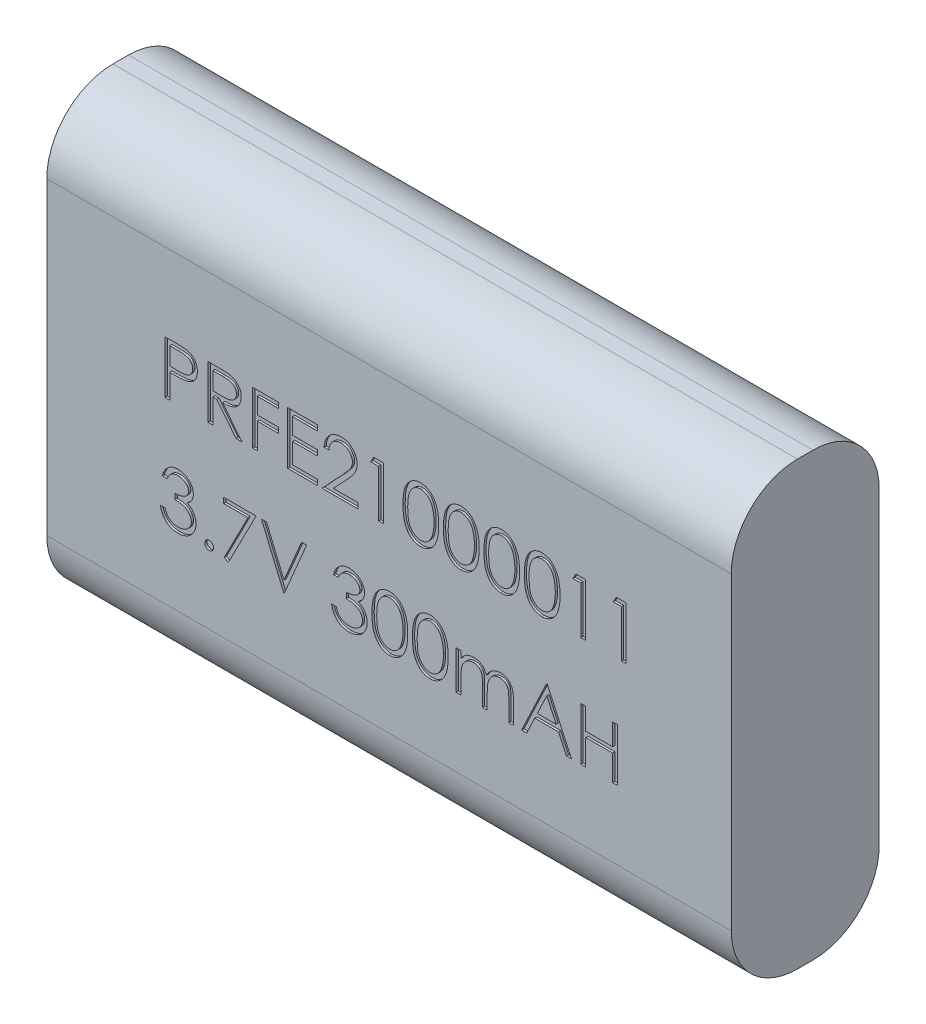
from build123d import *

# Parameters (mm, degrees)
SKETCH1_W           = 31
SKETCH1_H           = 20
BOSS_EXTRUDE1_DEPTH = 6.7
FILLET1_R           = 3
CUT_EXTRUDE1_DEPTH  = 0.1


with BuildPart() as part:
    # Sketch1 → Boss-Extrude1 (new body)
    with BuildSketch(Plane.XY):
        Rectangle(SKETCH1_W, SKETCH1_H)
    extrude(amount=BOSS_EXTRUDE1_DEPTH)

    # Fillet1
    fillet1_edges = [part.edges().sort_by_distance(p)[0] for p in [
        (0, -10, 6.7),
        (0, -10, 0),
        (0, 10, 0),
        (0, 10, 6.7),
    ]]
    fillet(fillet1_edges, radius=FILLET1_R)

    # Sketch3 → Cut-Extrude1 (cut)
    # profile 1 of 22: a face of its own
    with BuildSketch(Plane.XY.offset(6.7)):
        with BuildLine():
            Line((-10.144994863, 3.475542045), (-9.67799892, 3.475542045))
            add(Edge.make_bspline(
                [(-9.67799892, 3.475542045), (-9.645878643, 3.475506737), (-9.584334765, 3.475439085), (-9.4960822, 3.473387981), (-9.415929508, 3.470648392), (-9.344049517, 3.466850712), (-9.280221064, 3.462362674), (-9.224732973, 3.456067983), (-9.177149096, 3.449495532), (-9.148637744, 3.442813468), (-9.135634887, 3.439766053)],
                knots=[0, 0, 0, 0, 1.415646017, 2.712440637, 3.8905458, 4.950247383, 5.884950622, 6.709939814, 7.411656543, 8, 8, 8, 8], degree=3))
            add(Edge.make_bspline(
                [(-9.135634887, 3.439766053), (-9.119174644, 3.435260762), (-9.086642022, 3.426356342), (-9.039764705, 3.408521648), (-8.995164678, 3.387374675), (-8.952688921, 3.363273744), (-8.912859397, 3.335184816), (-8.875081858, 3.304246515), (-8.839689693, 3.269744537), (-8.806881925, 3.232065855), (-8.776752447, 3.191842998), (-8.750810645, 3.148475517), (-8.729088728, 3.102693398), (-8.710458323, 3.054528486), (-8.697049535, 3.00357632), (-8.686948341, 2.950190931), (-8.680536909, 2.894378044), (-8.679922844, 2.856237313), (-8.679610248, 2.836821342)],
                knots=[0, 0, 0, 0, 0.999701418, 1.975846123, 2.934577507, 3.890451536, 4.834027766, 5.787354733, 6.749476667, 7.726910423, 8.712836071, 9.690891519, 10.682875813, 11.679750201, 12.712814741, 13.765529915, 14.8625177, 16, 16, 16, 16], degree=3))
            add(Edge.make_bspline(
                [(-8.679610248, 2.836821342), (-8.679896967, 2.817242176), (-8.680457953, 2.778934215), (-8.687190962, 2.7228913), (-8.696260253, 2.669334681), (-8.710205569, 2.618383109), (-8.728470214, 2.570339165), (-8.749896057, 2.524468648), (-8.775738423, 2.481551943), (-8.805432495, 2.441433243), (-8.838464919, 2.404074892), (-8.874695936, 2.369747612), (-8.913979276, 2.338652339), (-8.956190095, 2.310719362), (-9.001739902, 2.286596429), (-9.049937868, 2.26499012), (-9.101202926, 2.246844273), (-9.136678457, 2.237298821), (-9.154715416, 2.23244559)],
                knots=[0, 0, 0, 0, 1.121902311, 2.195077645, 3.232258892, 4.234102512, 5.217864754, 6.176164875, 7.132989551, 8.084763148, 9.034132444, 9.988522005, 10.94243251, 11.903244335, 12.886203696, 13.894208494, 14.929344452, 16, 16, 16, 16], degree=3))
            add(Edge.make_bspline(
                [(-9.154715416, 2.23244559), (-9.169633835, 2.229273098), (-9.202328416, 2.222320396), (-9.256173732, 2.214558571), (-9.318865504, 2.207933525), (-9.390318162, 2.202966144), (-9.47046757, 2.198713661), (-9.559357087, 2.195333583), (-9.6571612, 2.193476307), (-9.725381457, 2.193380518), (-9.76099922, 2.193330506)],
                knots=[0, 0, 0, 0, 0.601384939, 1.31797006, 2.144135048, 3.087295005, 4.142315834, 5.309527816, 6.595305764, 8, 8, 8, 8], degree=3))
            Line((-9.76099922, 2.193330506), (-9.93129294, 2.193330506))
            Line((-9.93129294, 2.193330506), (-9.93129294, 1.094292045))
            Line((-9.93129294, 1.094292045), (-10.144994863, 1.094292045))
            Line((-10.144994863, 1.094292045), (-10.144994863, 3.475542045))
        make_face()
        with BuildLine():
            Line((-9.93129294, 3.231311275), (-9.93129294, 2.437561275))
            Line((-9.93129294, 2.437561275), (-9.514383385, 2.43231413))
            add(Edge.make_bspline(
                [(-9.514383385, 2.43231413), (-9.49402715, 2.432303609), (-9.454729857, 2.432283299), (-9.397963427, 2.434994674), (-9.345297465, 2.43812468), (-9.296893745, 2.442707513), (-9.252730447, 2.449185369), (-9.212733932, 2.455724783), (-9.177214334, 2.465185396), (-9.135645056, 2.47792377), (-9.089324064, 2.499649353), (-9.038931678, 2.531183832), (-8.996225261, 2.571379814), (-8.95926942, 2.616574463), (-8.929942028, 2.666852264), (-8.908472684, 2.72064738), (-8.895858075, 2.777408113), (-8.894166575, 2.816248436), (-8.893312171, 2.835867315)],
                knots=[0, 0, 0, 0, 1.160613943, 2.240541288, 3.23993089, 4.169200891, 5.011653406, 5.7853311, 6.478053781, 7.106038997, 8.262395093, 9.384106736, 10.481365981, 11.59014053, 12.70357646, 13.786202915, 14.881775077, 16, 16, 16, 16], degree=3))
            add(Edge.make_bspline(
                [(-8.893312171, 2.835867315), (-8.894171222, 2.855011554), (-8.895878908, 2.893067931), (-8.908571558, 2.948842766), (-8.929900287, 3.002070986), (-8.959466292, 3.051718746), (-8.995349096, 3.096750772), (-9.037054542, 3.135869353), (-9.084484457, 3.167316618), (-9.128604415, 3.187613905), (-9.167793793, 3.200006797), (-9.201833394, 3.208677841), (-9.240267228, 3.215600887), (-9.283107807, 3.221206692), (-9.330023081, 3.226005564), (-9.381416113, 3.229261738), (-9.437092217, 3.231167729), (-9.475743695, 3.231262268), (-9.495779869, 3.231311275)],
                knots=[0, 0, 0, 0, 1.120700087, 2.227813068, 3.331159281, 4.466773991, 5.599788987, 6.693661531, 7.80175334, 8.91857717, 9.525282508, 10.207424825, 10.974604443, 11.810962634, 12.737642355, 13.736264703, 14.826523623, 16, 16, 16, 16], degree=3))
            Line((-9.495779869, 3.231311275), (-9.93129294, 3.231311275))
        make_face(mode=Mode.SUBTRACT)
    # profile 2 of 22: a face of its own
    with BuildSketch(Plane.XY.offset(6.7)):
        with BuildLine():
            Line((-8.19114871, 3.475542045), (-7.714612502, 3.475542045))
            add(Edge.make_bspline(
                [(-7.714612502, 3.475542045), (-7.682811841, 3.475436191), (-7.62175105, 3.475232939), (-7.534275307, 3.474099625), (-7.454791157, 3.470851358), (-7.383340159, 3.468056054), (-7.319923624, 3.462958859), (-7.264347093, 3.458087061), (-7.216866534, 3.451709624), (-7.188124267, 3.445786827), (-7.175110549, 3.443105146)],
                knots=[0, 0, 0, 0, 1.410062039, 2.707475311, 3.878576406, 4.937260626, 5.877586885, 6.699081471, 7.410979367, 8, 8, 8, 8], degree=3))
            add(Edge.make_bspline(
                [(-7.175110549, 3.443105146), (-7.157688899, 3.438800686), (-7.123217251, 3.430283591), (-7.073585152, 3.412281613), (-7.026290585, 3.391449333), (-6.981530008, 3.366981159), (-6.939527622, 3.33869546), (-6.899850343, 3.307080541), (-6.862318126, 3.272309389), (-6.828448838, 3.233505327), (-6.796513519, 3.19279513), (-6.769579114, 3.148773467), (-6.74636092, 3.102739464), (-6.727875264, 3.054224953), (-6.712990429, 3.003700426), (-6.702495077, 2.950708226), (-6.696200965, 2.895489777), (-6.695560167, 2.857826629), (-6.695235248, 2.838729394)],
                knots=[0, 0, 0, 0, 1.027469482, 2.033020251, 3.019912614, 3.986113645, 4.951240523, 5.91722682, 6.890402269, 7.87763091, 8.8651537, 9.85103654, 10.82876324, 11.815024772, 12.821070561, 13.842952187, 14.906261191, 16, 16, 16, 16], degree=3))
            add(Edge.make_bspline(
                [(-6.695235248, 2.838729394), (-6.696234691, 2.807000868), (-6.698184864, 2.745090295), (-6.716367479, 2.655241731), (-6.746151147, 2.571429001), (-6.787192528, 2.493757634), (-6.839457207, 2.423741642), (-6.902271038, 2.36224385), (-6.975669063, 2.310781695), (-7.043996865, 2.275095055), (-7.104354205, 2.252239879), (-7.154042941, 2.236158714), (-7.208244938, 2.223734055), (-7.266440875, 2.212603323), (-7.328872933, 2.204199759), (-7.395391478, 2.198044844), (-7.466043949, 2.194198072), (-7.514579994, 2.193625208), (-7.539548649, 2.193330506)],
                knots=[0, 0, 0, 0, 1.260483769, 2.459530307, 3.627416485, 4.787058657, 5.939039949, 7.08810263, 8.267026773, 9.491475466, 10.141966685, 10.831826277, 11.566392101, 12.351337768, 13.187381173, 14.07005841, 15.007169909, 16, 16, 16, 16], degree=3))
            Line((-7.539548649, 2.193330506), (-6.664706402, 1.094292045))
            Line((-6.664706402, 1.094292045), (-6.928971726, 1.094292045))
            Line((-6.928971726, 1.094292045), (-7.803813974, 2.193330506))
            Line((-7.803813974, 2.193330506), (-7.977446787, 2.193330506))
            Line((-7.977446787, 2.193330506), (-7.977446787, 1.094292045))
            Line((-7.977446787, 1.094292045), (-8.19114871, 1.094292045))
            Line((-8.19114871, 1.094292045), (-8.19114871, 3.475542045))
        make_face()
        with BuildLine():
            Line((-7.977446787, 3.231311275), (-7.977446787, 2.437561275))
            Line((-7.977446787, 2.437561275), (-7.541456702, 2.434222183))
            add(Edge.make_bspline(
                [(-7.541456702, 2.434222183), (-7.52110039, 2.434213177), (-7.481644059, 2.434195722), (-7.424561643, 2.436912916), (-7.371412067, 2.440003995), (-7.322398626, 2.444732032), (-7.277499426, 2.450825359), (-7.236736907, 2.45844739), (-7.200044531, 2.467327454), (-7.157251061, 2.481071774), (-7.109465135, 2.502847297), (-7.057532481, 2.534528467), (-7.013307677, 2.574376385), (-6.975943917, 2.619942255), (-6.945920143, 2.670041202), (-6.924752834, 2.724072696), (-6.911320923, 2.780672694), (-6.90973668, 2.819574228), (-6.908937171, 2.839206408)],
                knots=[0, 0, 0, 0, 1.146690395, 2.22261258, 3.21895312, 4.145990853, 4.996080663, 5.770904154, 6.481378293, 7.121626537, 8.300444488, 9.431385265, 10.535395872, 11.636531494, 12.74115979, 13.810798291, 14.895190096, 16, 16, 16, 16], degree=3))
            add(Edge.make_bspline(
                [(-6.908937171, 2.839206408), (-6.909755043, 2.85835613), (-6.911375766, 2.896303893), (-6.924607875, 2.951859074), (-6.9469844, 3.004292124), (-6.977139351, 3.053389747), (-7.013878062, 3.097957042), (-7.056956788, 3.136089123), (-7.105197644, 3.167555277), (-7.150285727, 3.187662811), (-7.190586147, 3.199990782), (-7.225576683, 3.208666128), (-7.265113242, 3.215636025), (-7.309387796, 3.221220438), (-7.358211334, 3.22602032), (-7.411830723, 3.229253227), (-7.469890211, 3.231167659), (-7.510131248, 3.231262289), (-7.530962412, 3.231311275)],
                knots=[0, 0, 0, 0, 1.101028733, 2.181837193, 3.264309656, 4.369019818, 5.486613113, 6.575447106, 7.666700264, 8.788928104, 9.402425223, 10.0903467, 10.862060571, 11.710948788, 12.657782767, 13.684531032, 14.801375019, 16, 16, 16, 16], degree=3))
            Line((-7.530962412, 3.231311275), (-7.977446787, 3.231311275))
        make_face(mode=Mode.SUBTRACT)
    # profile 3 of 22: a face of its own
    with BuildSketch(Plane.XY.offset(6.7)):
        Polygon((-6.176244863, 3.475542045), (-5.01614871, 3.475542045), (-5.01614871, 3.231311275), (-5.96254294, 3.231311275), (-5.96254294, 2.498618968), (-5.01614871, 2.498618968), (-5.01614871, 2.254388199), (-5.96254294, 2.254388199), (-5.96254294, 1.094292045), (-6.176244863, 1.094292045), align=None)
    # profile 4 of 22: a face of its own
    with BuildSketch(Plane.XY.offset(6.7)):
        Polygon((-4.588744863, 3.475542045), (-3.245475633, 3.475542045), (-3.245475633, 3.231311275), (-4.37504294, 3.231311275), (-4.37504294, 2.498618968), (-3.245475633, 2.498618968), (-3.245475633, 2.254388199), (-4.37504294, 2.254388199), (-4.37504294, 1.338522814), (-3.245475633, 1.338522814), (-3.245475633, 1.094292045), (-4.588744863, 1.094292045), align=None)
    # profile 5 of 22: a face of its own
    with BuildSketch(Plane.XY.offset(6.7)):
        with BuildLine():
            Line((-2.726485248, 2.742849737), (-2.940187171, 2.742849737))
            add(Edge.make_bspline(
                [(-2.940187171, 2.742849737), (-2.938794376, 2.771200823), (-2.936058963, 2.826881602), (-2.923249002, 2.908064474), (-2.904919584, 2.985662471), (-2.879003791, 3.059052537), (-2.846818627, 3.128883583), (-2.808221948, 3.194878236), (-2.762506132, 3.256784742), (-2.710658336, 3.314029205), (-2.654346101, 3.36654432), (-2.593586167, 3.41189369), (-2.529738033, 3.45020982), (-2.462995406, 3.482241879), (-2.392605272, 3.506285596), (-2.319206399, 3.524125676), (-2.242476308, 3.534859225), (-2.190197651, 3.536012965), (-2.163609647, 3.536599737)],
                knots=[0, 0, 0, 0, 1.10065271, 2.161652631, 3.183658789, 4.190468796, 5.17591951, 6.163126047, 7.15150782, 8.156236427, 9.156009102, 10.134482811, 11.092018607, 12.041330605, 13.001268258, 13.972401359, 14.968799086, 16, 16, 16, 16], degree=3))
            add(Edge.make_bspline(
                [(-2.163609647, 3.536599737), (-2.13749885, 3.535988466), (-2.086192067, 3.53478734), (-2.01131059, 3.524472425), (-1.940024609, 3.508316942), (-1.872473468, 3.485650561), (-1.809196127, 3.455181156), (-1.749717234, 3.418579616), (-1.693328683, 3.376247909), (-1.642569425, 3.326409154), (-1.595959464, 3.273203603), (-1.555748822, 3.216402012), (-1.521313795, 3.157735301), (-1.492611106, 3.096756114), (-1.47148184, 3.032890289), (-1.455440237, 2.967067639), (-1.446372836, 2.89860683), (-1.444981218, 2.852270048), (-1.44427371, 2.828712117)],
                knots=[0, 0, 0, 0, 1.111607364, 2.184268762, 3.212621178, 4.221274766, 5.211760367, 6.196651075, 7.1921475, 8.207485113, 9.220403448, 10.201281604, 11.166441695, 12.114753415, 13.065576456, 14.026450734, 14.996634279, 16, 16, 16, 16], degree=3))
            add(Edge.make_bspline(
                [(-1.44427371, 2.828712117), (-1.445425733, 2.795546179), (-1.447709564, 2.72979632), (-1.467245595, 2.633175493), (-1.497757239, 2.539562828), (-1.534494726, 2.464221913), (-1.571555443, 2.403511269), (-1.604952479, 2.35352631), (-1.644049074, 2.29970634), (-1.689414266, 2.24223158), (-1.740109631, 2.180651839), (-1.796594353, 2.115004318), (-1.859271222, 2.045967274), (-1.903262095, 1.998814713), (-1.926057063, 1.974381438)],
                knots=[0, 0, 0, 0, 1.184426356, 2.348067706, 3.509069118, 4.696110526, 5.333549288, 6.050745305, 6.844228056, 7.710549037, 8.667450064, 9.695053472, 10.805634456, 12, 12, 12, 12], degree=3))
            Line((-1.926057063, 1.974381438), (-2.521846576, 1.338522814))
            Line((-2.521846576, 1.338522814), (-1.413744863, 1.338522814))
            Line((-1.413744863, 1.338522814), (-1.413744863, 1.094292045))
            Line((-1.413744863, 1.094292045), (-3.03177371, 1.094292045))
            Line((-3.03177371, 1.094292045), (-2.108276113, 2.07980136))
            add(Edge.make_bspline(
                [(-2.108276113, 2.07980136), (-2.085791748, 2.103272529), (-2.042603882, 2.148355842), (-1.981519665, 2.214175605), (-1.926656353, 2.275237347), (-1.877658806, 2.331425695), (-1.835589939, 2.383562529), (-1.798257224, 2.429959283), (-1.76834492, 2.472654721), (-1.73588141, 2.522144318), (-1.704439397, 2.582568412), (-1.677420812, 2.656410083), (-1.660946067, 2.732424517), (-1.658969741, 2.783792867), (-1.657975633, 2.809631588)],
                knots=[0, 0, 0, 0, 1.329631726, 2.553950428, 3.673215718, 4.687767853, 5.603093632, 6.413772471, 7.123043292, 7.734684054, 8.834405432, 9.900288307, 10.943827018, 12, 12, 12, 12], degree=3))
            add(Edge.make_bspline(
                [(-1.657975633, 2.809631588), (-1.658408164, 2.825879468), (-1.659260602, 2.857900919), (-1.666783785, 2.90484948), (-1.678152897, 2.950137327), (-1.694444225, 2.993903762), (-1.715948096, 3.035708751), (-1.742123735, 3.075603179), (-1.772324832, 3.114171922), (-1.807262034, 3.150335148), (-1.845642015, 3.183455753), (-1.886187388, 3.212795533), (-1.929083977, 3.237314999), (-1.974150917, 3.257415129), (-2.021262567, 3.273182665), (-2.070510045, 3.284108234), (-2.121757278, 3.290967924), (-2.156750424, 3.291896048), (-2.174580951, 3.292368968)],
                knots=[0, 0, 0, 0, 0.991446411, 1.95395049, 2.89581595, 3.838931463, 4.798493298, 5.75982156, 6.748411868, 7.785213223, 8.824556874, 9.840280684, 10.836137867, 11.835679398, 12.848801643, 13.863922112, 14.911575587, 16, 16, 16, 16], degree=3))
            add(Edge.make_bspline(
                [(-2.174580951, 3.292368968), (-2.193202893, 3.29188249), (-2.229773311, 3.290927129), (-2.283466439, 3.28424421), (-2.334687656, 3.272714986), (-2.383565807, 3.25694657), (-2.430183597, 3.236904236), (-2.474314313, 3.211940746), (-2.515858886, 3.182152333), (-2.554895413, 3.148379026), (-2.590861799, 3.110777319), (-2.622462263, 3.06886054), (-2.650073886, 3.023394031), (-2.674164811, 2.974500471), (-2.69372895, 2.921736203), (-2.70867854, 2.865288532), (-2.720507806, 2.805402556), (-2.724459674, 2.76404699), (-2.726485248, 2.742849737)],
                knots=[0, 0, 0, 0, 1.031018746, 2.02475058, 2.990194455, 3.934040569, 4.864654155, 5.795059489, 6.735614925, 7.690564532, 8.649604399, 9.611025574, 10.590972636, 11.591080095, 12.624614302, 13.701020113, 14.821632451, 16, 16, 16, 16], degree=3))
        make_face()
    # profile 6 of 22: a face of its own
    with BuildSketch(Plane.XY.offset(6.7)):
        Polygon((-0.693931913, 3.475542045), (-0.25364871, 3.475542045), (-0.25364871, 1.094292045), (-0.467350633, 1.094292045), (-0.467350633, 3.231311275), (-0.833696787, 3.231311275), align=None)
    # profile 7 of 22: a face of its own
    with BuildSketch(Plane.XY.offset(6.7)):
        with BuildLine():
            add(Edge.make_bspline(
                [(0.631687829, 2.283963018), (0.631910998, 2.322129277), (0.632344508, 2.396267784), (0.637167166, 2.504298049), (0.645178604, 2.605644246), (0.656157781, 2.700311225), (0.669518621, 2.788323425), (0.687354515, 2.869445644), (0.707637868, 2.944053341), (0.731145871, 3.012389806), (0.757671492, 3.075375707), (0.786541945, 3.13417571), (0.818902992, 3.188700846), (0.852905142, 3.239821379), (0.889924784, 3.2867005), (0.928908425, 3.33000024), (0.971377594, 3.368719875), (1.015888605, 3.403993877), (1.06284445, 3.43491575), (1.110906692, 3.46215231), (1.160406148, 3.485420434), (1.211477962, 3.503715534), (1.263663095, 3.518826842), (1.317143974, 3.529160751), (1.372008902, 3.535662862), (1.409041718, 3.536284482), (1.427822895, 3.536599737)],
                knots=[0, 0, 0, 0, 1.646270934, 3.197905019, 4.663502075, 6.030701355, 7.308322542, 8.50163776, 9.611534131, 10.641858119, 11.616356847, 12.558055219, 13.465016945, 14.349605745, 15.204443733, 16.039544428, 16.859896111, 17.680448484, 18.487036065, 19.28249412, 20.06191084, 20.843045899, 21.620316918, 22.403196591, 23.190181807, 24, 24, 24, 24], degree=3))
            add(Edge.make_bspline(
                [(1.427822895, 3.536599737), (1.446760962, 3.536267848), (1.484422818, 3.535607827), (1.540103502, 3.529264216), (1.594497839, 3.518738327), (1.647373929, 3.503824235), (1.699166108, 3.485321462), (1.749469271, 3.462130048), (1.798595874, 3.435134248), (1.845765231, 3.40341336), (1.891495174, 3.368046847), (1.934662449, 3.328067245), (1.975270984, 3.28387824), (2.013830433, 3.235952615), (2.049246831, 3.183371155), (2.082974469, 3.127048395), (2.113163301, 3.06599936), (2.142238142, 3.001242649), (2.167334467, 2.930986481), (2.189967395, 2.855626885), (2.208254693, 2.774273733), (2.223487395, 2.687353859), (2.235288118, 2.594548053), (2.243882827, 2.496055256), (2.248422908, 2.391810669), (2.249277913, 2.320537918), (2.249716675, 2.283963018)],
                knots=[0, 0, 0, 0, 0.810914788, 1.612654377, 2.396697861, 3.181598691, 3.963628158, 4.749916497, 5.551656086, 6.361998678, 7.18212741, 8.025565596, 8.878627764, 9.750805457, 10.657531673, 11.591944965, 12.560506719, 13.57287815, 14.630710178, 15.753379473, 16.941251878, 18.199788006, 19.531962791, 20.947069417, 22.433333509, 24, 24, 24, 24], degree=3))
            add(Edge.make_bspline(
                [(2.249716675, 2.283963018), (2.249273365, 2.247547645), (2.248409593, 2.176593776), (2.243933723, 2.072818237), (2.235117226, 1.97484814), (2.224088644, 1.882448522), (2.208813971, 1.796003963), (2.190032599, 1.715215329), (2.169179433, 1.639733738), (2.143438261, 1.570177554), (2.115264188, 1.505576471), (2.084610564, 1.445251143), (2.051769843, 1.388668362), (2.015990714, 1.336281034), (1.977854374, 1.287718055), (1.936544593, 1.243836636), (1.893225856, 1.203579447), (1.847361337, 1.167757536), (1.799456335, 1.13640341), (1.750498463, 1.108363273), (1.699619054, 1.085753171), (1.647971135, 1.066339152), (1.594815943, 1.051507059), (1.540219737, 1.041251454), (1.484460227, 1.034058821), (1.446767376, 1.033510127), (1.427822895, 1.033234352)],
                knots=[0, 0, 0, 0, 1.561518951, 3.042555995, 4.452378317, 5.7783523, 7.031515105, 8.214008947, 9.334062868, 10.386615937, 11.391082383, 12.354592575, 13.286541444, 14.194233754, 15.072674879, 15.931287219, 16.775624067, 17.606195743, 18.42308326, 19.229000347, 20.022332153, 20.807536673, 21.593273796, 22.3848459, 23.188221202, 24, 24, 24, 24], degree=3))
            add(Edge.make_bspline(
                [(1.427822895, 1.033234352), (1.409042239, 1.033551641), (1.372010451, 1.034177271), (1.317137997, 1.040650006), (1.263877977, 1.051056411), (1.211967575, 1.065627351), (1.161140464, 1.083462802), (1.11208924, 1.106699504), (1.064268513, 1.133460719), (1.017805865, 1.163937604), (0.973574377, 1.198854678), (0.931325147, 1.237474667), (0.892119554, 1.28076131), (0.855629214, 1.328031111), (0.820948629, 1.378849192), (0.789047109, 1.433909388), (0.759539438, 1.492993379), (0.732567706, 1.556482886), (0.708654062, 1.625304364), (0.687530532, 1.700245144), (0.67085215, 1.781966675), (0.656576246, 1.869812598), (0.645061621, 1.964160397), (0.637200554, 2.065061292), (0.632341909, 2.172452408), (0.631909834, 2.246114522), (0.631687829, 2.283963018)],
                knots=[0, 0, 0, 0, 0.810891512, 1.598919785, 2.382837074, 3.152667961, 3.926044502, 4.706494248, 5.493654104, 6.291793342, 7.103789334, 7.925228297, 8.761435821, 9.622817696, 10.50288917, 11.416980706, 12.369136599, 13.353924996, 14.394355917, 15.514179734, 16.714354668, 17.994756427, 19.357759367, 20.818452758, 22.365282078, 24, 24, 24, 24], degree=3))
        make_face()
        with BuildLine():
            add(Edge.make_bspline(
                [(0.845389752, 2.284917045), (0.845471019, 2.253111234), (0.845628741, 2.191382399), (0.849749121, 2.101681895), (0.855362225, 2.018018154), (0.862602107, 1.940284944), (0.873353756, 1.868745382), (0.885400696, 1.802907437), (0.900061093, 1.743119531), (0.91740681, 1.688971395), (0.937163767, 1.639544083), (0.958735078, 1.593551113), (0.981908534, 1.550449171), (1.00784317, 1.510625412), (1.03608824, 1.473949968), (1.066005761, 1.439773702), (1.098712287, 1.409295756), (1.143958583, 1.372742306), (1.203691542, 1.334969467), (1.278952959, 1.302076859), (1.356288101, 1.281405938), (1.408778505, 1.278777204), (1.434978093, 1.277465122)],
                knots=[0, 0, 0, 0, 1.459021318, 2.831673884, 4.118529203, 5.306027144, 6.411944654, 7.436330062, 8.375795394, 9.233974572, 10.042671642, 10.816086306, 11.563610507, 12.285937304, 12.993564865, 13.685989202, 14.367179055, 15.041617293, 16.353048772, 17.594441528, 18.799311195, 20, 20, 20, 20], degree=3))
            add(Edge.make_bspline(
                [(1.434978093, 1.277465122), (1.461347152, 1.278552183), (1.514030827, 1.280724062), (1.591002213, 1.301678203), (1.665726022, 1.333294086), (1.724285681, 1.370678014), (1.768837197, 1.406279967), (1.800757507, 1.436633861), (1.830055079, 1.470621692), (1.857842276, 1.507292463), (1.883327826, 1.547346778), (1.906502925, 1.590592031), (1.927650702, 1.637148311), (1.939699178, 1.669648794), (1.945859253, 1.686265452)],
                knots=[0, 0, 0, 0, 1.353760809, 2.704726607, 4.075137775, 5.516104923, 6.260822281, 7.007110065, 7.778089737, 8.566572457, 9.372053459, 10.217411131, 11.088608312, 12, 12, 12, 12], degree=3))
            add(Edge.make_bspline(
                [(1.945859253, 1.686265452), (1.953038224, 1.707512828), (1.967614613, 1.750654114), (1.986400481, 1.817576528), (2.001195118, 1.887791265), (2.014505194, 1.960878711), (2.023590041, 2.037377865), (2.030902392, 2.117052029), (2.035209521, 2.199961278), (2.035743432, 2.256291441), (2.036014752, 2.284917045)],
                knots=[0, 0, 0, 0, 0.884706709, 1.796334032, 2.740027952, 3.714592787, 4.726048262, 5.777819803, 6.87074269, 8, 8, 8, 8], degree=3))
            add(Edge.make_bspline(
                [(2.036014752, 2.284917045), (2.035640427, 2.313538018), (2.034908167, 2.369526761), (2.032109186, 2.451522166), (2.024881361, 2.529401124), (2.016853746, 2.603499142), (2.005017423, 2.673406045), (1.992255415, 2.739707056), (1.97510959, 2.801580793), (1.956794529, 2.859995972), (1.935832456, 2.914288918), (1.912757644, 2.964712761), (1.888113912, 3.01151094), (1.861347137, 3.054555056), (1.832775074, 3.094037911), (1.801643599, 3.129167876), (1.769187588, 3.161033742), (1.723728039, 3.197407383), (1.664214281, 3.234494804), (1.590160367, 3.268625437), (1.513095875, 3.288225365), (1.460998579, 3.290988763), (1.434978093, 3.292368968)],
                knots=[0, 0, 0, 0, 1.31362396, 2.569729283, 3.763502607, 4.902122613, 5.988968491, 7.01645872, 7.998833611, 8.933434873, 9.825090667, 10.667526885, 11.477055099, 12.250526234, 12.991942729, 13.710640831, 14.402115721, 15.076753259, 16.378508321, 17.609869233, 18.806226677, 20, 20, 20, 20], degree=3))
            add(Edge.make_bspline(
                [(1.434978093, 3.292368968), (1.408641065, 3.290986859), (1.35591903, 3.288220122), (1.278053547, 3.268698462), (1.203415407, 3.234671784), (1.144059026, 3.197284544), (1.098567772, 3.1616758), (1.066534725, 3.130796802), (1.036499561, 3.097019618), (1.008831001, 3.060006887), (0.982916685, 3.020229557), (0.959117103, 2.977374701), (0.937674063, 2.931225148), (0.917886191, 2.881820037), (0.900487562, 2.827676573), (0.886136133, 2.767962311), (0.872877978, 2.702333774), (0.863492268, 2.630406752), (0.855148534, 2.552654073), (0.849786403, 2.468781469), (0.845614958, 2.378930524), (0.845466324, 2.316882525), (0.845389752, 2.284917045)],
                knots=[0, 0, 0, 0, 1.207732386, 2.417664972, 3.655092373, 4.956220595, 5.625982001, 6.301752483, 6.994047911, 7.697131622, 8.419323945, 9.170223765, 9.943494443, 10.752040957, 11.610060368, 12.549350801, 13.567764191, 14.679664412, 15.874934091, 17.154273443, 18.533957287, 20, 20, 20, 20], degree=3))
        make_face(mode=Mode.SUBTRACT)
    # profile 8 of 22: a face of its own
    with BuildSketch(Plane.XY.offset(6.7)):
        with BuildLine():
            add(Edge.make_bspline(
                [(2.463418598, 2.283963018), (2.463641768, 2.322129277), (2.464075278, 2.396267784), (2.468897935, 2.504298049), (2.476909374, 2.605644246), (2.487888551, 2.700311225), (2.501249391, 2.788323425), (2.519085284, 2.869445644), (2.539368637, 2.944053341), (2.562876641, 3.012389806), (2.589402261, 3.075375707), (2.618272714, 3.13417571), (2.650633761, 3.188700846), (2.684635911, 3.239821379), (2.721655553, 3.2867005), (2.760639194, 3.33000024), (2.803108364, 3.368719875), (2.847619375, 3.403993877), (2.894575219, 3.43491575), (2.942637462, 3.46215231), (2.992136917, 3.485420434), (3.043208731, 3.503715534), (3.095393864, 3.518826842), (3.148874744, 3.529160751), (3.203739672, 3.535662862), (3.240772487, 3.536284482), (3.259553664, 3.536599737)],
                knots=[0, 0, 0, 0, 1.646270934, 3.197905019, 4.663502075, 6.030701355, 7.308322542, 8.50163776, 9.611534131, 10.641858119, 11.616356847, 12.558055219, 13.465016945, 14.349605745, 15.204443733, 16.039544428, 16.859896111, 17.680448484, 18.487036065, 19.28249412, 20.06191084, 20.843045899, 21.620316918, 22.403196591, 23.190181807, 24, 24, 24, 24], degree=3))
            add(Edge.make_bspline(
                [(3.259553664, 3.536599737), (3.278491731, 3.536267848), (3.316153587, 3.535607827), (3.371834271, 3.529264216), (3.426228608, 3.518738327), (3.479104699, 3.503824235), (3.530896877, 3.485321462), (3.58120004, 3.462130048), (3.630326644, 3.435134248), (3.677496, 3.40341336), (3.723225944, 3.368046847), (3.766393218, 3.328067245), (3.807001754, 3.28387824), (3.845561203, 3.235952615), (3.8809776, 3.183371155), (3.914705239, 3.127048395), (3.94489407, 3.06599936), (3.973968912, 3.001242649), (3.999065237, 2.930986481), (4.021698164, 2.855626885), (4.039985462, 2.774273733), (4.055218164, 2.687353859), (4.067018888, 2.594548053), (4.075613596, 2.496055256), (4.080153677, 2.391810669), (4.081008683, 2.320537918), (4.081447444, 2.283963018)],
                knots=[0, 0, 0, 0, 0.810914788, 1.612654377, 2.396697861, 3.181598691, 3.963628158, 4.749916497, 5.551656086, 6.361998678, 7.18212741, 8.025565596, 8.878627764, 9.750805457, 10.657531673, 11.591944965, 12.560506719, 13.57287815, 14.630710178, 15.753379473, 16.941251878, 18.199788006, 19.531962791, 20.947069417, 22.433333509, 24, 24, 24, 24], degree=3))
            add(Edge.make_bspline(
                [(4.081447444, 2.283963018), (4.081004134, 2.247547645), (4.080140362, 2.176593776), (4.075664492, 2.072818237), (4.066847995, 1.97484814), (4.055819413, 1.882448522), (4.04054474, 1.796003963), (4.021763368, 1.715215329), (4.000910202, 1.639733738), (3.97516903, 1.570177554), (3.946994957, 1.505576471), (3.916341333, 1.445251143), (3.883500612, 1.388668362), (3.847721484, 1.336281034), (3.809585143, 1.287718055), (3.768275362, 1.243836636), (3.724956625, 1.203579447), (3.679092106, 1.167757536), (3.631187104, 1.13640341), (3.582229232, 1.108363273), (3.531349823, 1.085753171), (3.479701904, 1.066339152), (3.426546712, 1.051507059), (3.371950507, 1.041251454), (3.316190996, 1.034058821), (3.278498146, 1.033510127), (3.259553664, 1.033234352)],
                knots=[0, 0, 0, 0, 1.561518951, 3.042555995, 4.452378317, 5.7783523, 7.031515105, 8.214008947, 9.334062868, 10.386615937, 11.391082383, 12.354592575, 13.286541444, 14.194233754, 15.072674879, 15.931287219, 16.775624067, 17.606195743, 18.42308326, 19.229000347, 20.022332153, 20.807536673, 21.593273796, 22.3848459, 23.188221202, 24, 24, 24, 24], degree=3))
            add(Edge.make_bspline(
                [(3.259553664, 1.033234352), (3.240773008, 1.033551641), (3.20374122, 1.034177271), (3.148868766, 1.040650006), (3.095608747, 1.051056411), (3.043698344, 1.065627351), (2.992871233, 1.083462802), (2.94382001, 1.106699504), (2.895999282, 1.133460719), (2.849536634, 1.163937604), (2.805305146, 1.198854678), (2.763055916, 1.237474667), (2.723850323, 1.28076131), (2.687359983, 1.328031111), (2.652679398, 1.378849192), (2.620777878, 1.433909388), (2.591270207, 1.492993379), (2.564298475, 1.556482886), (2.540384831, 1.625304364), (2.519261301, 1.700245144), (2.502582919, 1.781966675), (2.488307015, 1.869812598), (2.476792391, 1.964160397), (2.468931323, 2.065061292), (2.464072678, 2.172452408), (2.463640603, 2.246114522), (2.463418598, 2.283963018)],
                knots=[0, 0, 0, 0, 0.810891512, 1.598919785, 2.382837074, 3.152667961, 3.926044502, 4.706494248, 5.493654104, 6.291793342, 7.103789334, 7.925228297, 8.761435821, 9.622817696, 10.50288917, 11.416980706, 12.369136599, 13.353924996, 14.394355917, 15.514179734, 16.714354668, 17.994756427, 19.357759367, 20.818452758, 22.365282078, 24, 24, 24, 24], degree=3))
        make_face()
        with BuildLine():
            add(Edge.make_bspline(
                [(2.677120521, 2.284917045), (2.677201788, 2.253111234), (2.67735951, 2.191382399), (2.68147989, 2.101681895), (2.687092994, 2.018018154), (2.694332877, 1.940284944), (2.705084526, 1.868745382), (2.717131465, 1.802907437), (2.731791862, 1.743119531), (2.749137579, 1.688971395), (2.768894536, 1.639544083), (2.790465847, 1.593551113), (2.813639303, 1.550449171), (2.83957394, 1.510625412), (2.867819009, 1.473949968), (2.89773653, 1.439773702), (2.930443056, 1.409295756), (2.975689353, 1.372742306), (3.035422311, 1.334969467), (3.110683728, 1.302076859), (3.188018871, 1.281405938), (3.240509275, 1.278777204), (3.266708863, 1.277465122)],
                knots=[0, 0, 0, 0, 1.459021318, 2.831673884, 4.118529203, 5.306027144, 6.411944654, 7.436330062, 8.375795394, 9.233974572, 10.042671642, 10.816086306, 11.563610507, 12.285937304, 12.993564865, 13.685989202, 14.367179055, 15.041617293, 16.353048772, 17.594441528, 18.799311195, 20, 20, 20, 20], degree=3))
            add(Edge.make_bspline(
                [(3.266708863, 1.277465122), (3.293077921, 1.278552183), (3.345761597, 1.280724062), (3.422732982, 1.301678203), (3.497456791, 1.333294086), (3.55601645, 1.370678014), (3.600567966, 1.406279967), (3.632488276, 1.436633861), (3.661785848, 1.470621692), (3.689573045, 1.507292463), (3.715058595, 1.547346778), (3.738233694, 1.590592031), (3.759381472, 1.637148311), (3.771429948, 1.669648794), (3.777590022, 1.686265452)],
                knots=[0, 0, 0, 0, 1.353760809, 2.704726607, 4.075137775, 5.516104923, 6.260822281, 7.007110065, 7.778089737, 8.566572457, 9.372053459, 10.217411131, 11.088608312, 12, 12, 12, 12], degree=3))
            add(Edge.make_bspline(
                [(3.777590022, 1.686265452), (3.784768993, 1.707512828), (3.799345382, 1.750654114), (3.81813125, 1.817576528), (3.832925888, 1.887791265), (3.846235963, 1.960878711), (3.85532081, 2.037377865), (3.862633162, 2.117052029), (3.86694029, 2.199961278), (3.867474201, 2.256291441), (3.867745521, 2.284917045)],
                knots=[0, 0, 0, 0, 0.884706709, 1.796334032, 2.740027952, 3.714592787, 4.726048262, 5.777819803, 6.87074269, 8, 8, 8, 8], degree=3))
            add(Edge.make_bspline(
                [(3.867745521, 2.284917045), (3.867371196, 2.313538018), (3.866638936, 2.369526761), (3.863839955, 2.451522166), (3.85661213, 2.529401124), (3.848584515, 2.603499142), (3.836748192, 2.673406045), (3.823986184, 2.739707056), (3.806840359, 2.801580793), (3.788525298, 2.859995972), (3.767563225, 2.914288918), (3.744488413, 2.964712761), (3.719844681, 3.01151094), (3.693077907, 3.054555056), (3.664505844, 3.094037911), (3.633374368, 3.129167876), (3.600918357, 3.161033742), (3.555458808, 3.197407383), (3.49594505, 3.234494804), (3.421891136, 3.268625437), (3.344826644, 3.288225365), (3.292729348, 3.290988763), (3.266708863, 3.292368968)],
                knots=[0, 0, 0, 0, 1.31362396, 2.569729283, 3.763502607, 4.902122613, 5.988968491, 7.01645872, 7.998833611, 8.933434873, 9.825090667, 10.667526885, 11.477055099, 12.250526234, 12.991942729, 13.710640831, 14.402115721, 15.076753259, 16.378508321, 17.609869233, 18.806226677, 20, 20, 20, 20], degree=3))
            add(Edge.make_bspline(
                [(3.266708863, 3.292368968), (3.240371835, 3.290986859), (3.187649799, 3.288220122), (3.109784316, 3.268698462), (3.035146177, 3.234671784), (2.975789796, 3.197284544), (2.930298541, 3.1616758), (2.898265494, 3.130796802), (2.86823033, 3.097019618), (2.84056177, 3.060006887), (2.814647454, 3.020229557), (2.790847873, 2.977374701), (2.769404832, 2.931225148), (2.74961696, 2.881820037), (2.732218331, 2.827676573), (2.717866903, 2.767962311), (2.704608747, 2.702333774), (2.695223037, 2.630406752), (2.686879303, 2.552654073), (2.681517172, 2.468781469), (2.677345727, 2.378930524), (2.677197093, 2.316882525), (2.677120521, 2.284917045)],
                knots=[0, 0, 0, 0, 1.207732386, 2.417664972, 3.655092373, 4.956220595, 5.625982001, 6.301752483, 6.994047911, 7.697131622, 8.419323945, 9.170223765, 9.943494443, 10.752040957, 11.610060368, 12.549350801, 13.567764191, 14.679664412, 15.874934091, 17.154273443, 18.533957287, 20, 20, 20, 20], degree=3))
        make_face(mode=Mode.SUBTRACT)
    # profile 9 of 22: a face of its own
    with BuildSketch(Plane.XY.offset(6.7)):
        with BuildLine():
            add(Edge.make_bspline(
                [(4.295149367, 2.283963018), (4.295372537, 2.322129277), (4.295806047, 2.396267784), (4.300628705, 2.504298049), (4.308640143, 2.605644246), (4.31961932, 2.700311225), (4.33298016, 2.788323425), (4.350816053, 2.869445644), (4.371099407, 2.944053341), (4.39460741, 3.012389806), (4.421133031, 3.075375707), (4.450003483, 3.13417571), (4.482364531, 3.188700846), (4.51636668, 3.239821379), (4.553386322, 3.2867005), (4.592369963, 3.33000024), (4.634839133, 3.368719875), (4.679350144, 3.403993877), (4.726305988, 3.43491575), (4.774368231, 3.46215231), (4.823867687, 3.485420434), (4.8749395, 3.503715534), (4.927124634, 3.518826842), (4.980605513, 3.529160751), (5.035470441, 3.535662862), (5.072503256, 3.536284482), (5.091284433, 3.536599737)],
                knots=[0, 0, 0, 0, 1.646270934, 3.197905019, 4.663502075, 6.030701355, 7.308322542, 8.50163776, 9.611534131, 10.641858119, 11.616356847, 12.558055219, 13.465016945, 14.349605745, 15.204443733, 16.039544428, 16.859896111, 17.680448484, 18.487036065, 19.28249412, 20.06191084, 20.843045899, 21.620316918, 22.403196591, 23.190181807, 24, 24, 24, 24], degree=3))
            add(Edge.make_bspline(
                [(5.091284433, 3.536599737), (5.1102225, 3.536267848), (5.147884356, 3.535607827), (5.20356504, 3.529264216), (5.257959377, 3.518738327), (5.310835468, 3.503824235), (5.362627646, 3.485321462), (5.412930809, 3.462130048), (5.462057413, 3.435134248), (5.509226769, 3.40341336), (5.554956713, 3.368046847), (5.598123988, 3.328067245), (5.638732523, 3.28387824), (5.677291972, 3.235952615), (5.712708369, 3.183371155), (5.746436008, 3.127048395), (5.776624839, 3.06599936), (5.805699681, 3.001242649), (5.830796006, 2.930986481), (5.853428933, 2.855626885), (5.871716232, 2.774273733), (5.886948933, 2.687353859), (5.898749657, 2.594548053), (5.907344365, 2.496055256), (5.911884446, 2.391810669), (5.912739452, 2.320537918), (5.913178213, 2.283963018)],
                knots=[0, 0, 0, 0, 0.810914788, 1.612654377, 2.396697861, 3.181598691, 3.963628158, 4.749916497, 5.551656086, 6.361998678, 7.18212741, 8.025565596, 8.878627764, 9.750805457, 10.657531673, 11.591944965, 12.560506719, 13.57287815, 14.630710178, 15.753379473, 16.941251878, 18.199788006, 19.531962791, 20.947069417, 22.433333509, 24, 24, 24, 24], degree=3))
            add(Edge.make_bspline(
                [(5.913178213, 2.283963018), (5.912734903, 2.247547645), (5.911871131, 2.176593776), (5.907395261, 2.072818237), (5.898578764, 1.97484814), (5.887550183, 1.882448522), (5.87227551, 1.796003963), (5.853494138, 1.715215329), (5.832640972, 1.639733738), (5.806899799, 1.570177554), (5.778725727, 1.505576471), (5.748072102, 1.445251143), (5.715231381, 1.388668362), (5.679452253, 1.336281034), (5.641315913, 1.287718055), (5.600006131, 1.243836636), (5.556687394, 1.203579447), (5.510822875, 1.167757536), (5.462917874, 1.13640341), (5.413960002, 1.108363273), (5.363080593, 1.085753171), (5.311432673, 1.066339152), (5.258277481, 1.051507059), (5.203681276, 1.041251454), (5.147921765, 1.034058821), (5.110228915, 1.033510127), (5.091284433, 1.033234352)],
                knots=[0, 0, 0, 0, 1.561518951, 3.042555995, 4.452378317, 5.7783523, 7.031515105, 8.214008947, 9.334062868, 10.386615937, 11.391082383, 12.354592575, 13.286541444, 14.194233754, 15.072674879, 15.931287219, 16.775624067, 17.606195743, 18.42308326, 19.229000347, 20.022332153, 20.807536673, 21.593273796, 22.3848459, 23.188221202, 24, 24, 24, 24], degree=3))
            add(Edge.make_bspline(
                [(5.091284433, 1.033234352), (5.072503777, 1.033551641), (5.035471989, 1.034177271), (4.980599535, 1.040650006), (4.927339516, 1.051056411), (4.875429114, 1.065627351), (4.824602002, 1.083462802), (4.775550779, 1.106699504), (4.727730051, 1.133460719), (4.681267403, 1.163937604), (4.637035915, 1.198854678), (4.594786685, 1.237474667), (4.555581092, 1.28076131), (4.519090752, 1.328031111), (4.484410167, 1.378849192), (4.452508647, 1.433909388), (4.423000977, 1.492993379), (4.396029245, 1.556482886), (4.3721156, 1.625304364), (4.35099207, 1.700245144), (4.334313688, 1.781966675), (4.320037785, 1.869812598), (4.30852316, 1.964160397), (4.300662092, 2.065061292), (4.295803447, 2.172452408), (4.295371373, 2.246114522), (4.295149367, 2.283963018)],
                knots=[0, 0, 0, 0, 0.810891512, 1.598919785, 2.382837074, 3.152667961, 3.926044502, 4.706494248, 5.493654104, 6.291793342, 7.103789334, 7.925228297, 8.761435821, 9.622817696, 10.50288917, 11.416980706, 12.369136599, 13.353924996, 14.394355917, 15.514179734, 16.714354668, 17.994756427, 19.357759367, 20.818452758, 22.365282078, 24, 24, 24, 24], degree=3))
        make_face()
        with BuildLine():
            add(Edge.make_bspline(
                [(4.50885129, 2.284917045), (4.508932557, 2.253111234), (4.50909028, 2.191382399), (4.513210659, 2.101681895), (4.518823763, 2.018018154), (4.526063646, 1.940284944), (4.536815295, 1.868745382), (4.548862234, 1.802907437), (4.563522631, 1.743119531), (4.580868349, 1.688971395), (4.600625306, 1.639544083), (4.622196616, 1.593551113), (4.645370072, 1.550449171), (4.671304709, 1.510625412), (4.699549779, 1.473949968), (4.7294673, 1.439773702), (4.762173826, 1.409295756), (4.807420122, 1.372742306), (4.86715308, 1.334969467), (4.942414497, 1.302076859), (5.01974964, 1.281405938), (5.072240044, 1.278777204), (5.098439632, 1.277465122)],
                knots=[0, 0, 0, 0, 1.459021318, 2.831673884, 4.118529203, 5.306027144, 6.411944654, 7.436330062, 8.375795394, 9.233974572, 10.042671642, 10.816086306, 11.563610507, 12.285937304, 12.993564865, 13.685989202, 14.367179055, 15.041617293, 16.353048772, 17.594441528, 18.799311195, 20, 20, 20, 20], degree=3))
            add(Edge.make_bspline(
                [(5.098439632, 1.277465122), (5.124808691, 1.278552183), (5.177492366, 1.280724062), (5.254463751, 1.301678203), (5.32918756, 1.333294086), (5.387747219, 1.370678014), (5.432298736, 1.406279967), (5.464219045, 1.436633861), (5.493516617, 1.470621692), (5.521303815, 1.507292463), (5.546789364, 1.547346778), (5.569964463, 1.590592031), (5.591112241, 1.637148311), (5.603160717, 1.669648794), (5.609320792, 1.686265452)],
                knots=[0, 0, 0, 0, 1.353760809, 2.704726607, 4.075137775, 5.516104923, 6.260822281, 7.007110065, 7.778089737, 8.566572457, 9.372053459, 10.217411131, 11.088608312, 12, 12, 12, 12], degree=3))
            add(Edge.make_bspline(
                [(5.609320792, 1.686265452), (5.616499762, 1.707512828), (5.631076151, 1.750654114), (5.649862019, 1.817576528), (5.664656657, 1.887791265), (5.677966732, 1.960878711), (5.687051579, 2.037377865), (5.694363931, 2.117052029), (5.698671059, 2.199961278), (5.69920497, 2.256291441), (5.69947629, 2.284917045)],
                knots=[0, 0, 0, 0, 0.884706709, 1.796334032, 2.740027952, 3.714592787, 4.726048262, 5.777819803, 6.87074269, 8, 8, 8, 8], degree=3))
            add(Edge.make_bspline(
                [(5.69947629, 2.284917045), (5.699101965, 2.313538018), (5.698369705, 2.369526761), (5.695570724, 2.451522166), (5.688342899, 2.529401124), (5.680315285, 2.603499142), (5.668478961, 2.673406045), (5.655716953, 2.739707056), (5.638571128, 2.801580793), (5.620256067, 2.859995972), (5.599293994, 2.914288918), (5.576219182, 2.964712761), (5.55157545, 3.01151094), (5.524808676, 3.054555056), (5.496236613, 3.094037911), (5.465105137, 3.129167876), (5.432649127, 3.161033742), (5.387189577, 3.197407383), (5.327675819, 3.234494804), (5.253621905, 3.268625437), (5.176557414, 3.288225365), (5.124460117, 3.290988763), (5.098439632, 3.292368968)],
                knots=[0, 0, 0, 0, 1.31362396, 2.569729283, 3.763502607, 4.902122613, 5.988968491, 7.01645872, 7.998833611, 8.933434873, 9.825090667, 10.667526885, 11.477055099, 12.250526234, 12.991942729, 13.710640831, 14.402115721, 15.076753259, 16.378508321, 17.609869233, 18.806226677, 20, 20, 20, 20], degree=3))
            add(Edge.make_bspline(
                [(5.098439632, 3.292368968), (5.072102604, 3.290986859), (5.019380569, 3.288220122), (4.941515085, 3.268698462), (4.866876946, 3.234671784), (4.807520565, 3.197284544), (4.76202931, 3.1616758), (4.729996263, 3.130796802), (4.6999611, 3.097019618), (4.672292539, 3.060006887), (4.646378224, 3.020229557), (4.622578642, 2.977374701), (4.601135601, 2.931225148), (4.581347729, 2.881820037), (4.5639491, 2.827676573), (4.549597672, 2.767962311), (4.536339516, 2.702333774), (4.526953806, 2.630406752), (4.518610073, 2.552654073), (4.513247941, 2.468781469), (4.509076496, 2.378930524), (4.508927863, 2.316882525), (4.50885129, 2.284917045)],
                knots=[0, 0, 0, 0, 1.207732386, 2.417664972, 3.655092373, 4.956220595, 5.625982001, 6.301752483, 6.994047911, 7.697131622, 8.419323945, 9.170223765, 9.943494443, 10.752040957, 11.610060368, 12.549350801, 13.567764191, 14.679664412, 15.874934091, 17.154273443, 18.533957287, 20, 20, 20, 20], degree=3))
        make_face(mode=Mode.SUBTRACT)
    # profile 10 of 22: a face of its own
    with BuildSketch(Plane.XY.offset(6.7)):
        with BuildLine():
            add(Edge.make_bspline(
                [(6.126880137, 2.283963018), (6.127103306, 2.322129277), (6.127536816, 2.396267784), (6.132359474, 2.504298049), (6.140370912, 2.605644246), (6.151350089, 2.700311225), (6.164710929, 2.788323425), (6.182546823, 2.869445644), (6.202830176, 2.944053341), (6.226338179, 3.012389806), (6.2528638, 3.075375707), (6.281734252, 3.13417571), (6.3140953, 3.188700846), (6.34809745, 3.239821379), (6.385117091, 3.2867005), (6.424100733, 3.33000024), (6.466569902, 3.368719875), (6.511080913, 3.403993877), (6.558036757, 3.43491575), (6.606099, 3.46215231), (6.655598456, 3.485420434), (6.70667027, 3.503715534), (6.758855403, 3.518826842), (6.812336282, 3.529160751), (6.86720121, 3.535662862), (6.904234026, 3.536284482), (6.923015203, 3.536599737)],
                knots=[0, 0, 0, 0, 1.646270934, 3.197905019, 4.663502075, 6.030701355, 7.308322542, 8.50163776, 9.611534131, 10.641858119, 11.616356847, 12.558055219, 13.465016945, 14.349605745, 15.204443733, 16.039544428, 16.859896111, 17.680448484, 18.487036065, 19.28249412, 20.06191084, 20.843045899, 21.620316918, 22.403196591, 23.190181807, 24, 24, 24, 24], degree=3))
            add(Edge.make_bspline(
                [(6.923015203, 3.536599737), (6.941953269, 3.536267848), (6.979615125, 3.535607827), (7.035295809, 3.529264216), (7.089690146, 3.518738327), (7.142566237, 3.503824235), (7.194358415, 3.485321462), (7.244661578, 3.462130048), (7.293788182, 3.435134248), (7.340957538, 3.40341336), (7.386687482, 3.368046847), (7.429854757, 3.328067245), (7.470463292, 3.28387824), (7.509022741, 3.235952615), (7.544439138, 3.183371155), (7.578166777, 3.127048395), (7.608355609, 3.06599936), (7.63743045, 3.001242649), (7.662526775, 2.930986481), (7.685159703, 2.855626885), (7.703447001, 2.774273733), (7.718679702, 2.687353859), (7.730480426, 2.594548053), (7.739075134, 2.496055256), (7.743615215, 2.391810669), (7.744470221, 2.320537918), (7.744908983, 2.283963018)],
                knots=[0, 0, 0, 0, 0.810914788, 1.612654377, 2.396697861, 3.181598691, 3.963628158, 4.749916497, 5.551656086, 6.361998678, 7.18212741, 8.025565596, 8.878627764, 9.750805457, 10.657531673, 11.591944965, 12.560506719, 13.57287815, 14.630710178, 15.753379473, 16.941251878, 18.199788006, 19.531962791, 20.947069417, 22.433333509, 24, 24, 24, 24], degree=3))
            add(Edge.make_bspline(
                [(7.744908983, 2.283963018), (7.744465673, 2.247547645), (7.743601901, 2.176593776), (7.739126031, 2.072818237), (7.730309533, 1.97484814), (7.719280952, 1.882448522), (7.704006279, 1.796003963), (7.685224907, 1.715215329), (7.664371741, 1.639733738), (7.638630568, 1.570177554), (7.610456496, 1.505576471), (7.579802871, 1.445251143), (7.54696215, 1.388668362), (7.511183022, 1.336281034), (7.473046682, 1.287718055), (7.431736901, 1.243836636), (7.388418163, 1.203579447), (7.342553645, 1.167757536), (7.294648643, 1.13640341), (7.245690771, 1.108363273), (7.194811362, 1.085753171), (7.143163442, 1.066339152), (7.09000825, 1.051507059), (7.035412045, 1.041251454), (6.979652535, 1.034058821), (6.941959684, 1.033510127), (6.923015203, 1.033234352)],
                knots=[0, 0, 0, 0, 1.561518951, 3.042555995, 4.452378317, 5.7783523, 7.031515105, 8.214008947, 9.334062868, 10.386615937, 11.391082383, 12.354592575, 13.286541444, 14.194233754, 15.072674879, 15.931287219, 16.775624067, 17.606195743, 18.42308326, 19.229000347, 20.022332153, 20.807536673, 21.593273796, 22.3848459, 23.188221202, 24, 24, 24, 24], degree=3))
            add(Edge.make_bspline(
                [(6.923015203, 1.033234352), (6.904234547, 1.033551641), (6.867202758, 1.034177271), (6.812330305, 1.040650006), (6.759070285, 1.051056411), (6.707159883, 1.065627351), (6.656332772, 1.083462802), (6.607281548, 1.106699504), (6.55946082, 1.133460719), (6.512998173, 1.163937604), (6.468766684, 1.198854678), (6.426517455, 1.237474667), (6.387311861, 1.28076131), (6.350821521, 1.328031111), (6.316140936, 1.378849192), (6.284239416, 1.433909388), (6.254731746, 1.492993379), (6.227760014, 1.556482886), (6.20384637, 1.625304364), (6.18272284, 1.700245144), (6.166044457, 1.781966675), (6.151768554, 1.869812598), (6.140253929, 1.964160397), (6.132392861, 2.065061292), (6.127534217, 2.172452408), (6.127102142, 2.246114522), (6.126880137, 2.283963018)],
                knots=[0, 0, 0, 0, 0.810891512, 1.598919785, 2.382837074, 3.152667961, 3.926044502, 4.706494248, 5.493654104, 6.291793342, 7.103789334, 7.925228297, 8.761435821, 9.622817696, 10.50288917, 11.416980706, 12.369136599, 13.353924996, 14.394355917, 15.514179734, 16.714354668, 17.994756427, 19.357759367, 20.818452758, 22.365282078, 24, 24, 24, 24], degree=3))
        make_face()
        with BuildLine():
            add(Edge.make_bspline(
                [(6.34058206, 2.284917045), (6.340663326, 2.253111234), (6.340821049, 2.191382399), (6.344941428, 2.101681895), (6.350554533, 2.018018154), (6.357794415, 1.940284944), (6.368546064, 1.868745382), (6.380593004, 1.802907437), (6.3952534, 1.743119531), (6.412599118, 1.688971395), (6.432356075, 1.639544083), (6.453927386, 1.593551113), (6.477100842, 1.550449171), (6.503035478, 1.510625412), (6.531280548, 1.473949968), (6.561198069, 1.439773702), (6.593904595, 1.409295756), (6.639150891, 1.372742306), (6.69888385, 1.334969467), (6.774145266, 1.302076859), (6.851480409, 1.281405938), (6.903970813, 1.278777204), (6.930170401, 1.277465122)],
                knots=[0, 0, 0, 0, 1.459021318, 2.831673884, 4.118529203, 5.306027144, 6.411944654, 7.436330062, 8.375795394, 9.233974572, 10.042671642, 10.816086306, 11.563610507, 12.285937304, 12.993564865, 13.685989202, 14.367179055, 15.041617293, 16.353048772, 17.594441528, 18.799311195, 20, 20, 20, 20], degree=3))
            add(Edge.make_bspline(
                [(6.930170401, 1.277465122), (6.95653946, 1.278552183), (7.009223135, 1.280724062), (7.086194521, 1.301678203), (7.160918329, 1.333294086), (7.219477989, 1.370678014), (7.264029505, 1.406279967), (7.295949814, 1.436633861), (7.325247387, 1.470621692), (7.353034584, 1.507292463), (7.378520134, 1.547346778), (7.401695233, 1.590592031), (7.42284301, 1.637148311), (7.434891486, 1.669648794), (7.441051561, 1.686265452)],
                knots=[0, 0, 0, 0, 1.353760809, 2.704726607, 4.075137775, 5.516104923, 6.260822281, 7.007110065, 7.778089737, 8.566572457, 9.372053459, 10.217411131, 11.088608312, 12, 12, 12, 12], degree=3))
            add(Edge.make_bspline(
                [(7.441051561, 1.686265452), (7.448230531, 1.707512828), (7.46280692, 1.750654114), (7.481592788, 1.817576528), (7.496387426, 1.887791265), (7.509697502, 1.960878711), (7.518782349, 2.037377865), (7.5260947, 2.117052029), (7.530401828, 2.199961278), (7.530935739, 2.256291441), (7.53120706, 2.284917045)],
                knots=[0, 0, 0, 0, 0.884706709, 1.796334032, 2.740027952, 3.714592787, 4.726048262, 5.777819803, 6.87074269, 8, 8, 8, 8], degree=3))
            add(Edge.make_bspline(
                [(7.53120706, 2.284917045), (7.530832734, 2.313538018), (7.530100474, 2.369526761), (7.527301493, 2.451522166), (7.520073669, 2.529401124), (7.512046054, 2.603499142), (7.50020973, 2.673406045), (7.487447722, 2.739707056), (7.470301898, 2.801580793), (7.451986836, 2.859995972), (7.431024764, 2.914288918), (7.407949952, 2.964712761), (7.383306219, 3.01151094), (7.356539445, 3.054555056), (7.327967382, 3.094037911), (7.296835907, 3.129167876), (7.264379896, 3.161033742), (7.218920346, 3.197407383), (7.159406588, 3.234494804), (7.085352675, 3.268625437), (7.008288183, 3.288225365), (6.956190886, 3.290988763), (6.930170401, 3.292368968)],
                knots=[0, 0, 0, 0, 1.31362396, 2.569729283, 3.763502607, 4.902122613, 5.988968491, 7.01645872, 7.998833611, 8.933434873, 9.825090667, 10.667526885, 11.477055099, 12.250526234, 12.991942729, 13.710640831, 14.402115721, 15.076753259, 16.378508321, 17.609869233, 18.806226677, 20, 20, 20, 20], degree=3))
            add(Edge.make_bspline(
                [(6.930170401, 3.292368968), (6.903833373, 3.290986859), (6.851111338, 3.288220122), (6.773245854, 3.268698462), (6.698607715, 3.234671784), (6.639251334, 3.197284544), (6.593760079, 3.1616758), (6.561727033, 3.130796802), (6.531691869, 3.097019618), (6.504023309, 3.060006887), (6.478108993, 3.020229557), (6.454309411, 2.977374701), (6.432866371, 2.931225148), (6.413078499, 2.881820037), (6.39567987, 2.827676573), (6.381328441, 2.767962311), (6.368070285, 2.702333774), (6.358684576, 2.630406752), (6.350340842, 2.552654073), (6.34497871, 2.468781469), (6.340807266, 2.378930524), (6.340658632, 2.316882525), (6.34058206, 2.284917045)],
                knots=[0, 0, 0, 0, 1.207732386, 2.417664972, 3.655092373, 4.956220595, 5.625982001, 6.301752483, 6.994047911, 7.697131622, 8.419323945, 9.170223765, 9.943494443, 10.752040957, 11.610060368, 12.549350801, 13.567764191, 14.679664412, 15.874934091, 17.154273443, 18.533957287, 20, 20, 20, 20], degree=3))
        make_face(mode=Mode.SUBTRACT)
    # profile 11 of 22: a face of its own
    with BuildSketch(Plane.XY.offset(6.7)):
        Polygon((8.464721933, 3.475542045), (8.905005137, 3.475542045), (8.905005137, 1.094292045), (8.691303213, 1.094292045), (8.691303213, 3.231311275), (8.32495706, 3.231311275), align=None)
    # profile 12 of 22: a face of its own
    with BuildSketch(Plane.XY.offset(6.7)):
        Polygon((10.296452703, 3.475542045), (10.736735906, 3.475542045), (10.736735906, 1.094292045), (10.523033983, 1.094292045), (10.523033983, 3.231311275), (10.156687829, 3.231311275), align=None)
    # profile 13 of 22: a face of its own
    with BuildSketch(Plane.XY.offset(6.7)):
        with BuildLine():
            Line((-10.053408325, -2.042727186), (-10.267110248, -2.042727186))
            add(Edge.make_bspline(
                [(-10.267110248, -2.042727186), (-10.261320714, -2.018756514), (-10.25000265, -1.971895811), (-10.226395908, -1.904943728), (-10.200678915, -1.841586475), (-10.169798113, -1.783010396), (-10.136114479, -1.728038286), (-10.09752277, -1.67791697), (-10.055803459, -1.631371721), (-10.00965827, -1.590065036), (-9.961265377, -1.552660545), (-9.909942894, -1.520768765), (-9.85672339, -1.49333394), (-9.801238133, -1.470732318), (-9.743321935, -1.453706024), (-9.683498387, -1.441352911), (-9.62161072, -1.433330743), (-9.579600306, -1.432547813), (-9.558268601, -1.432150263)],
                knots=[0, 0, 0, 0, 1.162005537, 2.271625781, 3.343758855, 4.383309926, 5.390229558, 6.379919256, 7.361854164, 8.333198761, 9.295911338, 10.242430842, 11.177959212, 12.116337295, 13.062827104, 14.020064771, 14.994644689, 16, 16, 16, 16], degree=3))
            add(Edge.make_bspline(
                [(-9.558268601, -1.432150263), (-9.527188022, -1.433088632), (-9.465704819, -1.434944902), (-9.375378532, -1.451895617), (-9.288274571, -1.478718787), (-9.205346351, -1.515780377), (-9.128317382, -1.561491745), (-9.059780797, -1.615896325), (-9.000665578, -1.677944421), (-8.951071368, -1.746478541), (-8.912239985, -1.819722735), (-8.88360622, -1.895106414), (-8.866174326, -1.972450755), (-8.863915162, -2.024673118), (-8.862783325, -2.050836411)],
                knots=[0, 0, 0, 0, 1.083050992, 2.142477498, 3.193116406, 4.255571735, 5.30263384, 6.308962982, 7.297363603, 8.282367274, 9.249857812, 10.179914175, 11.08814088, 12, 12, 12, 12], degree=3))
            add(Edge.make_bspline(
                [(-8.862783325, -2.050836411), (-8.863574982, -2.076014248), (-8.865124133, -2.125283368), (-8.878277958, -2.197211744), (-8.900414237, -2.265003618), (-8.931077772, -2.328944373), (-8.970770862, -2.388628595), (-9.018853536, -2.444190567), (-9.075665169, -2.495876726), (-9.118717446, -2.52548551), (-9.140882033, -2.540728989)],
                knots=[0, 0, 0, 0, 1.024540389, 2.004866551, 2.965041327, 3.920577974, 4.882998113, 5.874504559, 6.905732034, 8, 8, 8, 8], degree=3))
            add(Edge.make_bspline(
                [(-9.140882033, -2.540728989), (-9.115551143, -2.552960566), (-9.065363323, -2.577194859), (-8.996953052, -2.624721723), (-8.934851497, -2.679596845), (-8.900218789, -2.722420328), (-8.88281788, -2.743936621)],
                knots=[0, 0, 0, 0, 1.015518401, 2.012035669, 3.001164323, 4, 4, 4, 4], degree=3))
            add(Edge.make_bspline(
                [(-8.88281788, -2.743936621), (-8.871359753, -2.759624127), (-8.848631132, -2.790742245), (-8.820576242, -2.840773278), (-8.795124684, -2.891358845), (-8.775292124, -2.943854798), (-8.759933833, -2.997652688), (-8.748955568, -3.052844889), (-8.742135572, -3.109476472), (-8.741158884, -3.14778907), (-8.74066794, -3.167047348)],
                knots=[0, 0, 0, 0, 1.025084078, 2.033381695, 3.024893161, 4.013698104, 4.991890475, 5.976764909, 6.982997093, 8, 8, 8, 8], degree=3))
            add(Edge.make_bspline(
                [(-8.74066794, -3.167047348), (-8.74188885, -3.200391462), (-8.744324925, -3.266922772), (-8.766099126, -3.365217181), (-8.799853848, -3.46130096), (-8.847789728, -3.553200092), (-8.906210301, -3.639183887), (-8.975713766, -3.716116161), (-9.055510412, -3.782245926), (-9.144504969, -3.837497885), (-9.24092323, -3.881665257), (-9.344048767, -3.91232041), (-9.452395678, -3.93228617), (-9.526695643, -3.934427165), (-9.564469773, -3.935515648)],
                knots=[0, 0, 0, 0, 0.955779014, 1.907060117, 2.875433937, 3.871313158, 4.872415639, 5.851225146, 6.836215519, 7.83643374, 8.849228613, 9.86973379, 10.916971861, 12, 12, 12, 12], degree=3))
            add(Edge.make_bspline(
                [(-9.564469773, -3.935515648), (-9.589928262, -3.934924953), (-9.640022077, -3.933762662), (-9.713666314, -3.925817042), (-9.78396197, -3.91130502), (-9.85100409, -3.891776522), (-9.91485223, -3.86701714), (-9.975311559, -3.83618424), (-10.03275404, -3.799913379), (-10.086637612, -3.75777642), (-10.136955852, -3.710640366), (-10.182371545, -3.657668432), (-10.223641868, -3.599839841), (-10.259661771, -3.536482905), (-10.292071912, -3.468416399), (-10.318728956, -3.39476876), (-10.342191458, -3.316198381), (-10.35309994, -3.261444776), (-10.358696787, -3.233352186)],
                knots=[0, 0, 0, 0, 1.048658725, 2.063410685, 3.046034179, 4.001477787, 4.936774919, 5.862367409, 6.792675028, 7.730719943, 8.675894397, 9.627829632, 10.600096036, 11.597688215, 12.626045268, 13.701542398, 14.82072376, 16, 16, 16, 16], degree=3))
            Line((-10.358696787, -3.233352186), (-10.144994863, -3.233352186))
            add(Edge.make_bspline(
                [(-10.144994863, -3.233352186), (-10.139427303, -3.25168714), (-10.128597913, -3.287350217), (-10.110164114, -3.338676568), (-10.089162665, -3.385728744), (-10.066632938, -3.428851903), (-10.042971174, -3.468470734), (-10.016495127, -3.503537613), (-9.989165762, -3.535592777), (-9.968564988, -3.553652594), (-9.958482694, -3.562491309)],
                knots=[0, 0, 0, 0, 1.198163088, 2.33053128, 3.407730985, 4.417276592, 5.372219308, 6.28897303, 7.162600585, 8, 8, 8, 8], degree=3))
            add(Edge.make_bspline(
                [(-9.958482694, -3.562491309), (-9.945150023, -3.572770372), (-9.918525836, -3.593296768), (-9.875140665, -3.619491626), (-9.829512591, -3.642189038), (-9.780652964, -3.659527052), (-9.729616129, -3.674207568), (-9.675577154, -3.683814564), (-9.619012794, -3.690405981), (-9.58039044, -3.690987639), (-9.560653668, -3.691284878)],
                knots=[0, 0, 0, 0, 0.946170439, 1.889420265, 2.845303464, 3.807233317, 4.801018734, 5.828864929, 6.890507805, 8, 8, 8, 8], degree=3))
            add(Edge.make_bspline(
                [(-9.560653668, -3.691284878), (-9.538369588, -3.690865843), (-9.494794994, -3.690046455), (-9.431212313, -3.682511019), (-9.370723496, -3.671536577), (-9.314000131, -3.654586851), (-9.260299196, -3.633644879), (-9.210373467, -3.60735016), (-9.163567544, -3.576499555), (-9.120480931, -3.54143452), (-9.081737648, -3.503047753), (-9.047624872, -3.462897789), (-9.018624879, -3.421153912), (-8.995231766, -3.377585119), (-8.976759696, -3.332371829), (-8.964184518, -3.285387161), (-8.955440898, -3.237015628), (-8.954728828, -3.204134669), (-8.954369863, -3.187558917)],
                knots=[0, 0, 0, 0, 1.217147791, 2.380027433, 3.494444702, 4.572153297, 5.609568379, 6.639424714, 7.649109417, 8.668170816, 9.669597737, 10.625200337, 11.543417969, 12.441394052, 13.322311151, 14.205496177, 15.095365482, 16, 16, 16, 16], degree=3))
            add(Edge.make_bspline(
                [(-8.954369863, -3.187558917), (-8.955411015, -3.16537156), (-8.957488138, -3.121107246), (-8.973346296, -3.055985111), (-8.999430416, -2.993240253), (-9.035946893, -2.933943189), (-9.080398522, -2.878986727), (-9.132353932, -2.82995238), (-9.192244566, -2.789491478), (-9.247367013, -2.761536517), (-9.29619295, -2.742461293), (-9.337977345, -2.729755648), (-9.384756391, -2.718996714), (-9.435964389, -2.708987115), (-9.491987185, -2.700468126), (-9.552763786, -2.693363962), (-9.61830651, -2.687679551), (-9.663680321, -2.685141073), (-9.687062171, -2.683832955)],
                knots=[0, 0, 0, 0, 1.07054697, 2.135767047, 3.216561865, 4.33974944, 5.486079747, 6.621378074, 7.775625952, 8.963672916, 9.598146892, 10.304877434, 11.070270905, 11.915000392, 12.823868403, 13.805723172, 14.86925407, 16, 16, 16, 16], degree=3))
            Line((-9.687062171, -2.683832955), (-9.687062171, -2.439602186))
            add(Edge.make_bspline(
                [(-9.687062171, -2.439602186), (-9.657601914, -2.439102257), (-9.599896507, -2.438123019), (-9.515604131, -2.426279355), (-9.434999967, -2.409895928), (-9.359870344, -2.384800824), (-9.291393273, -2.355654122), (-9.231984758, -2.321736815), (-9.18247711, -2.284034994), (-9.143110917, -2.241966737), (-9.113495495, -2.196848821), (-9.091841906, -2.149824809), (-9.07905097, -2.100482546), (-9.0773435, -2.066808495), (-9.076485248, -2.049882384)],
                knots=[0, 0, 0, 0, 1.321986639, 2.589447074, 3.816329219, 5.01088745, 6.139805852, 7.153945165, 8.075214402, 8.924034688, 9.728124013, 10.488707548, 11.240355623, 12, 12, 12, 12], degree=3))
            add(Edge.make_bspline(
                [(-9.076485248, -2.049882384), (-9.076767196, -2.03744699), (-9.077328117, -2.012707362), (-9.084401979, -1.976563343), (-9.095031907, -1.941524306), (-9.109645794, -1.90773926), (-9.129206197, -1.87544252), (-9.152614556, -1.844358738), (-9.180487495, -1.814665381), (-9.212427166, -1.786988235), (-9.246725197, -1.760611308), (-9.284314776, -1.73821828), (-9.324062516, -1.719069586), (-9.366012422, -1.703278835), (-9.410300631, -1.691400284), (-9.456719057, -1.682871435), (-9.505356213, -1.67753903), (-9.538538409, -1.676771304), (-9.555406522, -1.676381032)],
                knots=[0, 0, 0, 0, 0.884392785, 1.759457502, 2.611959086, 3.489218968, 4.37281399, 5.2945488, 6.255912374, 7.266815255, 8.301784654, 9.332968512, 10.37626691, 11.440494194, 12.520033166, 13.637162961, 14.798855837, 16, 16, 16, 16], degree=3))
            add(Edge.make_bspline(
                [(-9.555406522, -1.676381032), (-9.582519889, -1.677327655), (-9.635478601, -1.67917663), (-9.711824821, -1.695371181), (-9.782799225, -1.721209841), (-9.837049997, -1.752052485), (-9.877111176, -1.782498762), (-9.905738522, -1.809088743), (-9.933851226, -1.838638574), (-9.959599803, -1.87296829), (-9.985639776, -1.909753017), (-10.009346523, -1.950862701), (-10.032383206, -1.995224976), (-10.046264226, -2.02658647), (-10.053408325, -2.042727186)],
                knots=[0, 0, 0, 0, 1.472543308, 2.876219568, 4.221790263, 5.565193594, 6.249813518, 6.953379497, 7.687249741, 8.463570142, 9.283606569, 10.136032583, 11.040678096, 12, 12, 12, 12], degree=3))
        make_face()
    # profile 14 of 22: a face of its own
    with BuildSketch(Plane.XY.offset(6.7)):
        with BuildLine():
            add(Edge.make_bspline(
                [(-8.14535544, -3.508111801), (-8.132095135, -3.508899768), (-8.106099857, -3.510444486), (-8.068517522, -3.521042187), (-8.034503298, -3.539859954), (-8.004205467, -3.564939809), (-7.979231954, -3.595348822), (-7.959743564, -3.629091753), (-7.94923818, -3.666988729), (-7.947704715, -3.693134633), (-7.94691794, -3.706549301)],
                knots=[0, 0, 0, 0, 1.020151414, 1.999887582, 2.974338812, 3.990962822, 5.007586832, 5.987933904, 6.967670073, 8, 8, 8, 8], degree=3))
            add(Edge.make_bspline(
                [(-7.94691794, -3.706549301), (-7.947731376, -3.719641638), (-7.949335459, -3.745459534), (-7.959719483, -3.783070672), (-7.979380478, -3.816834691), (-8.004033214, -3.847656325), (-8.034510788, -3.87278931), (-8.068597937, -3.891446978), (-8.106011632, -3.902803486), (-8.132080417, -3.904250127), (-8.14535544, -3.904986801)],
                knots=[0, 0, 0, 0, 1.009421747, 1.99056486, 2.972319754, 3.999869655, 5.017953583, 5.993804169, 6.978383603, 8, 8, 8, 8], degree=3))
            add(Edge.make_bspline(
                [(-8.14535544, -3.904986801), (-8.15864003, -3.904276783), (-8.184575028, -3.90289064), (-8.221849071, -3.891213802), (-8.256143812, -3.872964269), (-8.286615451, -3.847609461), (-8.311474661, -3.816993292), (-8.330269788, -3.782838142), (-8.341557014, -3.745567199), (-8.343041467, -3.719662844), (-8.34379294, -3.706549301)],
                knots=[0, 0, 0, 0, 1.022052826, 1.995314843, 2.982371812, 4.00089066, 5.028879526, 6.005146991, 6.990147033, 8, 8, 8, 8], degree=3))
            add(Edge.make_bspline(
                [(-8.34379294, -3.706549301), (-8.343070334, -3.69311267), (-8.341659532, -3.666879296), (-8.330246092, -3.629324189), (-8.311620491, -3.595191733), (-8.286443606, -3.564986203), (-8.256151183, -3.539685556), (-8.221931801, -3.52127183), (-8.184485256, -3.510358621), (-8.158624923, -3.50887373), (-8.14535544, -3.508111801)],
                knots=[0, 0, 0, 0, 1.032775665, 2.016367738, 2.991239715, 4.008302682, 5.025365648, 6.011011707, 6.979408107, 8, 8, 8, 8], degree=3))
        make_face()
    # profile 15 of 22: a face of its own
    with BuildSketch(Plane.XY.offset(6.7)):
        Polygon((-7.488985248, -1.493207955), (-6.023600633, -1.493207955), (-7.275283325, -3.935515648), (-7.459887442, -3.833911832), (-6.385176654, -1.737438725), (-7.488985248, -1.737438725), align=None)
    # profile 16 of 22: a face of its own
    with BuildSketch(Plane.XY.offset(6.7)):
        Polygon((-5.779369863, -1.493207955), (-5.550403517, -1.493207955), (-4.756653517, -3.369777967), (-3.962903517, -1.493207955), (-3.733937171, -1.493207955), (-4.741389094, -3.874457955), (-4.77191794, -3.874457955), align=None)
    # profile 17 of 22: a face of its own
    with BuildSketch(Plane.XY.offset(6.7)):
        with BuildLine():
            Line((-2.299081402, -2.042727186), (-2.512783325, -2.042727186))
            add(Edge.make_bspline(
                [(-2.512783325, -2.042727186), (-2.506993791, -2.018756514), (-2.495675727, -1.971895811), (-2.472068985, -1.904943728), (-2.446351992, -1.841586475), (-2.41547119, -1.783010396), (-2.381787555, -1.728038286), (-2.343195847, -1.67791697), (-2.301476535, -1.631371721), (-2.255331347, -1.590065036), (-2.206938454, -1.552660545), (-2.155615971, -1.520768765), (-2.102396467, -1.49333394), (-2.04691121, -1.470732318), (-1.988995011, -1.453706024), (-1.929171464, -1.441352911), (-1.867283797, -1.433330743), (-1.825273383, -1.432547813), (-1.803941678, -1.432150263)],
                knots=[0, 0, 0, 0, 1.162005537, 2.271625781, 3.343758855, 4.383309926, 5.390229558, 6.379919256, 7.361854164, 8.333198761, 9.295911338, 10.242430842, 11.177959212, 12.116337295, 13.062827104, 14.020064771, 14.994644689, 16, 16, 16, 16], degree=3))
            add(Edge.make_bspline(
                [(-1.803941678, -1.432150263), (-1.772861098, -1.433088632), (-1.711377896, -1.434944902), (-1.621051609, -1.451895617), (-1.533947648, -1.478718787), (-1.451019428, -1.515780377), (-1.373990459, -1.561491745), (-1.305453874, -1.615896325), (-1.246338655, -1.677944421), (-1.196744445, -1.746478541), (-1.157913062, -1.819722735), (-1.129279297, -1.895106414), (-1.111847403, -1.972450755), (-1.109588239, -2.024673118), (-1.108456402, -2.050836411)],
                knots=[0, 0, 0, 0, 1.083050992, 2.142477498, 3.193116406, 4.255571735, 5.30263384, 6.308962982, 7.297363603, 8.282367274, 9.249857812, 10.179914175, 11.08814088, 12, 12, 12, 12], degree=3))
            add(Edge.make_bspline(
                [(-1.108456402, -2.050836411), (-1.109248059, -2.076014248), (-1.11079721, -2.125283368), (-1.123951035, -2.197211744), (-1.146087314, -2.265003618), (-1.176750849, -2.328944373), (-1.216443939, -2.388628595), (-1.264526613, -2.444190567), (-1.321338246, -2.495876726), (-1.364390523, -2.52548551), (-1.38655511, -2.540728989)],
                knots=[0, 0, 0, 0, 1.024540389, 2.004866551, 2.965041327, 3.920577974, 4.882998113, 5.874504559, 6.905732034, 8, 8, 8, 8], degree=3))
            add(Edge.make_bspline(
                [(-1.38655511, -2.540728989), (-1.36122422, -2.552960566), (-1.3110364, -2.577194859), (-1.242626129, -2.624721723), (-1.180524574, -2.679596845), (-1.145891866, -2.722420328), (-1.128490957, -2.743936621)],
                knots=[0, 0, 0, 0, 1.015518401, 2.012035669, 3.001164323, 4, 4, 4, 4], degree=3))
            add(Edge.make_bspline(
                [(-1.128490957, -2.743936621), (-1.11703283, -2.759624127), (-1.094304209, -2.790742245), (-1.066249319, -2.840773278), (-1.040797761, -2.891358845), (-1.020965201, -2.943854798), (-1.00560691, -2.997652688), (-0.994628645, -3.052844889), (-0.987808649, -3.109476472), (-0.986831961, -3.14778907), (-0.986341017, -3.167047348)],
                knots=[0, 0, 0, 0, 1.025084078, 2.033381695, 3.024893161, 4.013698104, 4.991890475, 5.976764909, 6.982997093, 8, 8, 8, 8], degree=3))
            add(Edge.make_bspline(
                [(-0.986341017, -3.167047348), (-0.987561927, -3.200391462), (-0.989998002, -3.266922772), (-1.011772202, -3.365217181), (-1.045526925, -3.46130096), (-1.093462805, -3.553200092), (-1.151883378, -3.639183887), (-1.221386843, -3.716116161), (-1.301183489, -3.782245926), (-1.390178046, -3.837497885), (-1.486596307, -3.881665257), (-1.589721844, -3.91232041), (-1.698068755, -3.93228617), (-1.77236872, -3.934427165), (-1.81014285, -3.935515648)],
                knots=[0, 0, 0, 0, 0.955779014, 1.907060117, 2.875433937, 3.871313158, 4.872415639, 5.851225146, 6.836215519, 7.83643374, 8.849228613, 9.86973379, 10.916971861, 12, 12, 12, 12], degree=3))
            add(Edge.make_bspline(
                [(-1.81014285, -3.935515648), (-1.835601338, -3.934924953), (-1.885695154, -3.933762662), (-1.959339391, -3.925817042), (-2.029635047, -3.91130502), (-2.096677167, -3.891776522), (-2.160525307, -3.86701714), (-2.220984636, -3.83618424), (-2.278427117, -3.799913379), (-2.332310689, -3.75777642), (-2.382628929, -3.710640366), (-2.428044622, -3.657668432), (-2.469314945, -3.599839841), (-2.505334848, -3.536482905), (-2.537744989, -3.468416399), (-2.564402032, -3.39476876), (-2.587864535, -3.316198381), (-2.598773017, -3.261444776), (-2.604369863, -3.233352186)],
                knots=[0, 0, 0, 0, 1.048658725, 2.063410685, 3.046034179, 4.001477787, 4.936774919, 5.862367409, 6.792675028, 7.730719943, 8.675894397, 9.627829632, 10.600096036, 11.597688215, 12.626045268, 13.701542398, 14.82072376, 16, 16, 16, 16], degree=3))
            Line((-2.604369863, -3.233352186), (-2.39066794, -3.233352186))
            add(Edge.make_bspline(
                [(-2.39066794, -3.233352186), (-2.38510038, -3.25168714), (-2.37427099, -3.287350217), (-2.355837191, -3.338676568), (-2.334835742, -3.385728744), (-2.312306015, -3.428851903), (-2.288644251, -3.468470734), (-2.262168204, -3.503537613), (-2.234838839, -3.535592777), (-2.214238065, -3.553652594), (-2.204155771, -3.562491309)],
                knots=[0, 0, 0, 0, 1.198163088, 2.33053128, 3.407730985, 4.417276592, 5.372219308, 6.28897303, 7.162600585, 8, 8, 8, 8], degree=3))
            add(Edge.make_bspline(
                [(-2.204155771, -3.562491309), (-2.1908231, -3.572770372), (-2.164198913, -3.593296768), (-2.120813742, -3.619491626), (-2.075185668, -3.642189038), (-2.026326041, -3.659527052), (-1.975289206, -3.674207568), (-1.921250231, -3.683814564), (-1.864685871, -3.690405981), (-1.826063517, -3.690987639), (-1.806326744, -3.691284878)],
                knots=[0, 0, 0, 0, 0.946170439, 1.889420265, 2.845303464, 3.807233317, 4.801018734, 5.828864929, 6.890507805, 8, 8, 8, 8], degree=3))
            add(Edge.make_bspline(
                [(-1.806326744, -3.691284878), (-1.784042665, -3.690865843), (-1.740468071, -3.690046455), (-1.67688539, -3.682511019), (-1.616396573, -3.671536577), (-1.559673208, -3.654586851), (-1.505972273, -3.633644879), (-1.456046544, -3.60735016), (-1.409240621, -3.576499555), (-1.366154008, -3.54143452), (-1.327410725, -3.503047753), (-1.293297949, -3.462897789), (-1.264297956, -3.421153912), (-1.240904843, -3.377585119), (-1.222432773, -3.332371829), (-1.209857595, -3.285387161), (-1.201113975, -3.237015628), (-1.200401905, -3.204134669), (-1.20004294, -3.187558917)],
                knots=[0, 0, 0, 0, 1.217147791, 2.380027433, 3.494444702, 4.572153297, 5.609568379, 6.639424714, 7.649109417, 8.668170816, 9.669597737, 10.625200337, 11.543417969, 12.441394052, 13.322311151, 14.205496177, 15.095365482, 16, 16, 16, 16], degree=3))
            add(Edge.make_bspline(
                [(-1.20004294, -3.187558917), (-1.201084092, -3.16537156), (-1.203161214, -3.121107246), (-1.219019373, -3.055985111), (-1.245103493, -2.993240253), (-1.28161997, -2.933943189), (-1.326071599, -2.878986727), (-1.378027009, -2.82995238), (-1.437917643, -2.789491478), (-1.49304009, -2.761536517), (-1.541866026, -2.742461293), (-1.583650422, -2.729755648), (-1.630429468, -2.718996714), (-1.681637466, -2.708987115), (-1.737660262, -2.700468126), (-1.798436863, -2.693363962), (-1.863979587, -2.687679551), (-1.909353398, -2.685141073), (-1.932735248, -2.683832955)],
                knots=[0, 0, 0, 0, 1.07054697, 2.135767047, 3.216561865, 4.33974944, 5.486079747, 6.621378074, 7.775625952, 8.963672916, 9.598146892, 10.304877434, 11.070270905, 11.915000392, 12.823868403, 13.805723172, 14.86925407, 16, 16, 16, 16], degree=3))
            Line((-1.932735248, -2.683832955), (-1.932735248, -2.439602186))
            add(Edge.make_bspline(
                [(-1.932735248, -2.439602186), (-1.903274991, -2.439102257), (-1.845569583, -2.438123019), (-1.761277208, -2.426279355), (-1.680673044, -2.409895928), (-1.605543421, -2.384800824), (-1.53706635, -2.355654122), (-1.477657835, -2.321736815), (-1.428150187, -2.284034994), (-1.388783994, -2.241966737), (-1.359168572, -2.196848821), (-1.337514983, -2.149824809), (-1.324724047, -2.100482546), (-1.323016577, -2.066808495), (-1.322158325, -2.049882384)],
                knots=[0, 0, 0, 0, 1.321986639, 2.589447074, 3.816329219, 5.01088745, 6.139805852, 7.153945165, 8.075214402, 8.924034688, 9.728124013, 10.488707548, 11.240355623, 12, 12, 12, 12], degree=3))
            add(Edge.make_bspline(
                [(-1.322158325, -2.049882384), (-1.322440272, -2.03744699), (-1.323001194, -2.012707362), (-1.330075056, -1.976563343), (-1.340704984, -1.941524306), (-1.355318871, -1.90773926), (-1.374879274, -1.87544252), (-1.398287633, -1.844358738), (-1.426160572, -1.814665381), (-1.458100242, -1.786988235), (-1.492398274, -1.760611308), (-1.529987853, -1.73821828), (-1.569735593, -1.719069586), (-1.611685499, -1.703278835), (-1.655973708, -1.691400284), (-1.702392134, -1.682871435), (-1.75102929, -1.67753903), (-1.784211486, -1.676771304), (-1.801079599, -1.676381032)],
                knots=[0, 0, 0, 0, 0.884392785, 1.759457502, 2.611959086, 3.489218968, 4.37281399, 5.2945488, 6.255912374, 7.266815255, 8.301784654, 9.332968512, 10.37626691, 11.440494194, 12.520033166, 13.637162961, 14.798855837, 16, 16, 16, 16], degree=3))
            add(Edge.make_bspline(
                [(-1.801079599, -1.676381032), (-1.828192966, -1.677327655), (-1.881151678, -1.67917663), (-1.957497898, -1.695371181), (-2.028472302, -1.721209841), (-2.082723073, -1.752052485), (-2.122784253, -1.782498762), (-2.151411599, -1.809088743), (-2.179524303, -1.838638574), (-2.20527288, -1.87296829), (-2.231312853, -1.909753017), (-2.2550196, -1.950862701), (-2.278056283, -1.995224976), (-2.291937303, -2.02658647), (-2.299081402, -2.042727186)],
                knots=[0, 0, 0, 0, 1.472543308, 2.876219568, 4.221790263, 5.565193594, 6.249813518, 6.953379497, 7.687249741, 8.463570142, 9.283606569, 10.136032583, 11.040678096, 12, 12, 12, 12], degree=3))
        make_face()
    # profile 18 of 22: a face of its own
    with BuildSketch(Plane.XY.offset(6.7)):
        with BuildLine():
            add(Edge.make_bspline(
                [(-0.772639094, -2.684786982), (-0.772415925, -2.646620723), (-0.771982415, -2.572482216), (-0.767159757, -2.464451951), (-0.759148319, -2.363105754), (-0.748169142, -2.268438775), (-0.734808302, -2.180426575), (-0.716972408, -2.099304356), (-0.696689055, -2.024696659), (-0.673181052, -1.956360194), (-0.646655431, -1.893374293), (-0.617784978, -1.83457429), (-0.585423931, -1.780049154), (-0.551421781, -1.728928621), (-0.51440214, -1.6820495), (-0.475418498, -1.63874976), (-0.432949329, -1.600030125), (-0.388438318, -1.564756123), (-0.341482473, -1.53383425), (-0.293420231, -1.50659769), (-0.243920775, -1.483329566), (-0.192848961, -1.465034466), (-0.140663828, -1.449923158), (-0.087182949, -1.439589249), (-0.032318021, -1.433087138), (0.004714795, -1.432465518), (0.023495972, -1.432150263)],
                knots=[0, 0, 0, 0, 1.646270934, 3.197905019, 4.663502075, 6.030701355, 7.308322542, 8.50163776, 9.611534131, 10.641858119, 11.616356847, 12.558055219, 13.465016945, 14.349605745, 15.204443733, 16.039544428, 16.859896111, 17.680448484, 18.487036065, 19.28249412, 20.06191084, 20.843045899, 21.620316918, 22.403196591, 23.190181807, 24, 24, 24, 24], degree=3))
            add(Edge.make_bspline(
                [(0.023495972, -1.432150263), (0.042434039, -1.432482152), (0.080095895, -1.433142173), (0.135776578, -1.439485784), (0.190170915, -1.450011673), (0.243047006, -1.464925765), (0.294839185, -1.483428538), (0.345142348, -1.506619952), (0.394268951, -1.533615752), (0.441438308, -1.56533664), (0.487168251, -1.600703153), (0.530335526, -1.640682755), (0.570944061, -1.68487176), (0.60950351, -1.732797385), (0.644919908, -1.785378845), (0.678647546, -1.841701605), (0.708836378, -1.90275064), (0.737911219, -1.967507351), (0.763007544, -2.037763519), (0.785640472, -2.113123115), (0.80392777, -2.194476267), (0.819160472, -2.281396141), (0.830961195, -2.374201947), (0.839555904, -2.472694744), (0.844095985, -2.576939331), (0.84495099, -2.648212082), (0.845389752, -2.684786982)],
                knots=[0, 0, 0, 0, 0.810914788, 1.612654377, 2.396697861, 3.181598691, 3.963628158, 4.749916497, 5.551656086, 6.361998678, 7.18212741, 8.025565596, 8.878627764, 9.750805457, 10.657531673, 11.591944965, 12.560506719, 13.57287815, 14.630710178, 15.753379473, 16.941251878, 18.199788006, 19.531962791, 20.947069417, 22.433333509, 24, 24, 24, 24], degree=3))
            add(Edge.make_bspline(
                [(0.845389752, -2.684786982), (0.844946442, -2.721202355), (0.84408267, -2.792156224), (0.8396068, -2.895931763), (0.830790302, -2.99390186), (0.819761721, -3.086301478), (0.804487048, -3.172746037), (0.785705676, -3.253534671), (0.76485251, -3.329016262), (0.739111338, -3.398572446), (0.710937265, -3.463173529), (0.68028364, -3.523498857), (0.64744292, -3.580081638), (0.611663791, -3.632468966), (0.573527451, -3.681031945), (0.53221767, -3.724913364), (0.488898933, -3.765170553), (0.443034414, -3.800992464), (0.395129412, -3.83234659), (0.34617154, -3.860386727), (0.295292131, -3.882996829), (0.243644211, -3.902410848), (0.190489019, -3.917242941), (0.135892814, -3.927498546), (0.080133304, -3.934691179), (0.042440453, -3.935239873), (0.023495972, -3.935515648)],
                knots=[0, 0, 0, 0, 1.561518951, 3.042555995, 4.452378317, 5.7783523, 7.031515105, 8.214008947, 9.334062868, 10.386615937, 11.391082383, 12.354592575, 13.286541444, 14.194233754, 15.072674879, 15.931287219, 16.775624067, 17.606195743, 18.42308326, 19.229000347, 20.022332153, 20.807536673, 21.593273796, 22.3848459, 23.188221202, 24, 24, 24, 24], degree=3))
            add(Edge.make_bspline(
                [(0.023495972, -3.935515648), (0.004715316, -3.935198359), (-0.032316472, -3.934572729), (-0.087188926, -3.928099994), (-0.140448946, -3.917693589), (-0.192359348, -3.903122649), (-0.243186459, -3.885287198), (-0.292237683, -3.862050496), (-0.34005841, -3.835289281), (-0.386521058, -3.804812396), (-0.430752546, -3.769895322), (-0.473001776, -3.731275333), (-0.512207369, -3.68798869), (-0.548697709, -3.640718889), (-0.583378294, -3.589900808), (-0.615279815, -3.534840612), (-0.644787485, -3.475756621), (-0.671759217, -3.412267114), (-0.695672861, -3.343445636), (-0.716796391, -3.268504856), (-0.733474773, -3.186783325), (-0.747750677, -3.098937402), (-0.759265302, -3.004589603), (-0.76712637, -2.903688708), (-0.771985014, -2.796297592), (-0.772417089, -2.722635478), (-0.772639094, -2.684786982)],
                knots=[0, 0, 0, 0, 0.810891512, 1.598919785, 2.382837074, 3.152667961, 3.926044502, 4.706494248, 5.493654104, 6.291793342, 7.103789334, 7.925228297, 8.761435821, 9.622817696, 10.50288917, 11.416980706, 12.369136599, 13.353924996, 14.394355917, 15.514179734, 16.714354668, 17.994756427, 19.357759367, 20.818452758, 22.365282078, 24, 24, 24, 24], degree=3))
        make_face()
        with BuildLine():
            add(Edge.make_bspline(
                [(-0.558937171, -2.683832955), (-0.558855904, -2.715638766), (-0.558698182, -2.777367601), (-0.554577803, -2.867068105), (-0.548964698, -2.950731846), (-0.541724816, -3.028465056), (-0.530973167, -3.100004618), (-0.518926227, -3.165842563), (-0.504265831, -3.225630469), (-0.486920113, -3.279778605), (-0.467163156, -3.329205917), (-0.445591845, -3.375198887), (-0.422418389, -3.418300829), (-0.396483753, -3.458124588), (-0.368238683, -3.494800032), (-0.338321162, -3.528976298), (-0.305614636, -3.559454244), (-0.26036834, -3.596007694), (-0.200635381, -3.633780533), (-0.125373964, -3.666673141), (-0.048038822, -3.687344062), (0.004451582, -3.689972796), (0.03065117, -3.691284878)],
                knots=[0, 0, 0, 0, 1.459021318, 2.831673884, 4.118529203, 5.306027144, 6.411944654, 7.436330062, 8.375795394, 9.233974572, 10.042671642, 10.816086306, 11.563610507, 12.285937304, 12.993564865, 13.685989202, 14.367179055, 15.041617293, 16.353048772, 17.594441528, 18.799311195, 20, 20, 20, 20], degree=3))
            add(Edge.make_bspline(
                [(0.03065117, -3.691284878), (0.057020229, -3.690197817), (0.109703904, -3.688025938), (0.18667529, -3.667071797), (0.261399099, -3.635455914), (0.319958758, -3.598071986), (0.364510274, -3.562470033), (0.396430583, -3.532116139), (0.425728156, -3.498128308), (0.453515353, -3.461457537), (0.479000903, -3.421403222), (0.502176002, -3.378157969), (0.523323779, -3.331601689), (0.535372255, -3.299101206), (0.54153233, -3.282484548)],
                knots=[0, 0, 0, 0, 1.353760809, 2.704726607, 4.075137775, 5.516104923, 6.260822281, 7.007110065, 7.778089737, 8.566572457, 9.372053459, 10.217411131, 11.088608312, 12, 12, 12, 12], degree=3))
            add(Edge.make_bspline(
                [(0.54153233, -3.282484548), (0.548711301, -3.261237172), (0.56328769, -3.218095886), (0.582073558, -3.151173472), (0.596868195, -3.080958735), (0.610178271, -3.007871289), (0.619263118, -2.931372135), (0.626575469, -2.851697971), (0.630882597, -2.768788722), (0.631416508, -2.712458559), (0.631687829, -2.683832955)],
                knots=[0, 0, 0, 0, 0.884706709, 1.796334032, 2.740027952, 3.714592787, 4.726048262, 5.777819803, 6.87074269, 8, 8, 8, 8], degree=3))
            add(Edge.make_bspline(
                [(0.631687829, -2.683832955), (0.631313504, -2.655211982), (0.630581244, -2.599223239), (0.627782263, -2.517227834), (0.620554438, -2.439348876), (0.612526823, -2.365250858), (0.600690499, -2.295343955), (0.587928492, -2.229042944), (0.570782667, -2.167169207), (0.552467606, -2.108754028), (0.531505533, -2.054461082), (0.508430721, -2.004037239), (0.483786989, -1.95723906), (0.457020214, -1.914194944), (0.428448151, -1.874712089), (0.397316676, -1.839582124), (0.364860665, -1.807716258), (0.319401115, -1.771342617), (0.259887358, -1.734255196), (0.185833444, -1.700124563), (0.108768952, -1.680524635), (0.056671656, -1.677761237), (0.03065117, -1.676381032)],
                knots=[0, 0, 0, 0, 1.31362396, 2.569729283, 3.763502607, 4.902122613, 5.988968491, 7.01645872, 7.998833611, 8.933434873, 9.825090667, 10.667526885, 11.477055099, 12.250526234, 12.991942729, 13.710640831, 14.402115721, 15.076753259, 16.378508321, 17.609869233, 18.806226677, 20, 20, 20, 20], degree=3))
            add(Edge.make_bspline(
                [(0.03065117, -1.676381032), (0.004314142, -1.677763141), (-0.048407893, -1.680529878), (-0.126273377, -1.700051538), (-0.200911516, -1.734078216), (-0.260267897, -1.771465456), (-0.305759151, -1.8070742), (-0.337792198, -1.837953198), (-0.367827362, -1.871730382), (-0.395495922, -1.908743113), (-0.421410238, -1.948520443), (-0.44520982, -1.991375299), (-0.46665286, -2.037524852), (-0.486440732, -2.086929963), (-0.503839361, -2.141073427), (-0.51819079, -2.200787689), (-0.531448945, -2.266416226), (-0.540834655, -2.338343248), (-0.549178389, -2.416095927), (-0.55454052, -2.499968531), (-0.558711965, -2.589819476), (-0.558860599, -2.651867475), (-0.558937171, -2.683832955)],
                knots=[0, 0, 0, 0, 1.207732386, 2.417664972, 3.655092373, 4.956220595, 5.625982001, 6.301752483, 6.994047911, 7.697131622, 8.419323945, 9.170223765, 9.943494443, 10.752040957, 11.610060368, 12.549350801, 13.567764191, 14.679664412, 15.874934091, 17.154273443, 18.533957287, 20, 20, 20, 20], degree=3))
        make_face(mode=Mode.SUBTRACT)
    # profile 19 of 22: a face of its own
    with BuildSketch(Plane.XY.offset(6.7)):
        with BuildLine():
            add(Edge.make_bspline(
                [(1.059091675, -2.684786982), (1.059314845, -2.646620723), (1.059748354, -2.572482216), (1.064571012, -2.464451951), (1.072582451, -2.363105754), (1.083561627, -2.268438775), (1.096922468, -2.180426575), (1.114758361, -2.099304356), (1.135041714, -2.024696659), (1.158549718, -1.956360194), (1.185075338, -1.893374293), (1.213945791, -1.83457429), (1.246306838, -1.780049154), (1.280308988, -1.728928621), (1.31732863, -1.6820495), (1.356312271, -1.63874976), (1.39878144, -1.600030125), (1.443292451, -1.564756123), (1.490248296, -1.53383425), (1.538310538, -1.50659769), (1.587809994, -1.483329566), (1.638881808, -1.465034466), (1.691066941, -1.449923158), (1.744547821, -1.439589249), (1.799412749, -1.433087138), (1.836445564, -1.432465518), (1.855226741, -1.432150263)],
                knots=[0, 0, 0, 0, 1.646270934, 3.197905019, 4.663502075, 6.030701355, 7.308322542, 8.50163776, 9.611534131, 10.641858119, 11.616356847, 12.558055219, 13.465016945, 14.349605745, 15.204443733, 16.039544428, 16.859896111, 17.680448484, 18.487036065, 19.28249412, 20.06191084, 20.843045899, 21.620316918, 22.403196591, 23.190181807, 24, 24, 24, 24], degree=3))
            add(Edge.make_bspline(
                [(1.855226741, -1.432150263), (1.874164808, -1.432482152), (1.911826664, -1.433142173), (1.967507348, -1.439485784), (2.021901685, -1.450011673), (2.074777775, -1.464925765), (2.126569954, -1.483428538), (2.176873117, -1.506619952), (2.225999721, -1.533615752), (2.273169077, -1.56533664), (2.318899021, -1.600703153), (2.362066295, -1.640682755), (2.402674831, -1.68487176), (2.441234279, -1.732797385), (2.476650677, -1.785378845), (2.510378316, -1.841701605), (2.540567147, -1.90275064), (2.569641989, -1.967507351), (2.594738314, -2.037763519), (2.617371241, -2.113123115), (2.635658539, -2.194476267), (2.650891241, -2.281396141), (2.662691965, -2.374201947), (2.671286673, -2.472694744), (2.675826754, -2.576939331), (2.67668176, -2.648212082), (2.677120521, -2.684786982)],
                knots=[0, 0, 0, 0, 0.810914788, 1.612654377, 2.396697861, 3.181598691, 3.963628158, 4.749916497, 5.551656086, 6.361998678, 7.18212741, 8.025565596, 8.878627764, 9.750805457, 10.657531673, 11.591944965, 12.560506719, 13.57287815, 14.630710178, 15.753379473, 16.941251878, 18.199788006, 19.531962791, 20.947069417, 22.433333509, 24, 24, 24, 24], degree=3))
            add(Edge.make_bspline(
                [(2.677120521, -2.684786982), (2.676677211, -2.721202355), (2.675813439, -2.792156224), (2.671337569, -2.895931763), (2.662521072, -2.99390186), (2.65149249, -3.086301478), (2.636217817, -3.172746037), (2.617436445, -3.253534671), (2.596583279, -3.329016262), (2.570842107, -3.398572446), (2.542668034, -3.463173529), (2.51201441, -3.523498857), (2.479173689, -3.580081638), (2.44339456, -3.632468966), (2.40525822, -3.681031945), (2.363948439, -3.724913364), (2.320629702, -3.765170553), (2.274765183, -3.800992464), (2.226860181, -3.83234659), (2.177902309, -3.860386727), (2.1270229, -3.882996829), (2.075374981, -3.902410848), (2.022219789, -3.917242941), (1.967623584, -3.927498546), (1.911864073, -3.934691179), (1.874171223, -3.935239873), (1.855226741, -3.935515648)],
                knots=[0, 0, 0, 0, 1.561518951, 3.042555995, 4.452378317, 5.7783523, 7.031515105, 8.214008947, 9.334062868, 10.386615937, 11.391082383, 12.354592575, 13.286541444, 14.194233754, 15.072674879, 15.931287219, 16.775624067, 17.606195743, 18.42308326, 19.229000347, 20.022332153, 20.807536673, 21.593273796, 22.3848459, 23.188221202, 24, 24, 24, 24], degree=3))
            add(Edge.make_bspline(
                [(1.855226741, -3.935515648), (1.836446085, -3.935198359), (1.799414297, -3.934572729), (1.744541843, -3.928099994), (1.691281824, -3.917693589), (1.639371421, -3.903122649), (1.58854431, -3.885287198), (1.539493087, -3.862050496), (1.491672359, -3.835289281), (1.445209711, -3.804812396), (1.400978223, -3.769895322), (1.358728993, -3.731275333), (1.3195234, -3.68798869), (1.28303306, -3.640718889), (1.248352475, -3.589900808), (1.216450955, -3.534840612), (1.186943284, -3.475756621), (1.159971552, -3.412267114), (1.136057908, -3.343445636), (1.114934378, -3.268504856), (1.098255996, -3.186783325), (1.083980092, -3.098937402), (1.072465467, -3.004589603), (1.0646044, -2.903688708), (1.059745755, -2.796297592), (1.05931368, -2.722635478), (1.059091675, -2.684786982)],
                knots=[0, 0, 0, 0, 0.810891512, 1.598919785, 2.382837074, 3.152667961, 3.926044502, 4.706494248, 5.493654104, 6.291793342, 7.103789334, 7.925228297, 8.761435821, 9.622817696, 10.50288917, 11.416980706, 12.369136599, 13.353924996, 14.394355917, 15.514179734, 16.714354668, 17.994756427, 19.357759367, 20.818452758, 22.365282078, 24, 24, 24, 24], degree=3))
        make_face()
        with BuildLine():
            add(Edge.make_bspline(
                [(1.272793598, -2.683832955), (1.272874865, -2.715638766), (1.273032587, -2.777367601), (1.277152967, -2.867068105), (1.282766071, -2.950731846), (1.290005954, -3.028465056), (1.300757602, -3.100004618), (1.312804542, -3.165842563), (1.327464939, -3.225630469), (1.344810656, -3.279778605), (1.364567613, -3.329205917), (1.386138924, -3.375198887), (1.40931238, -3.418300829), (1.435247017, -3.458124588), (1.463492086, -3.494800032), (1.493409607, -3.528976298), (1.526116133, -3.559454244), (1.57136243, -3.596007694), (1.631095388, -3.633780533), (1.706356805, -3.666673141), (1.783691948, -3.687344062), (1.836182352, -3.689972796), (1.862381939, -3.691284878)],
                knots=[0, 0, 0, 0, 1.459021318, 2.831673884, 4.118529203, 5.306027144, 6.411944654, 7.436330062, 8.375795394, 9.233974572, 10.042671642, 10.816086306, 11.563610507, 12.285937304, 12.993564865, 13.685989202, 14.367179055, 15.041617293, 16.353048772, 17.594441528, 18.799311195, 20, 20, 20, 20], degree=3))
            add(Edge.make_bspline(
                [(1.862381939, -3.691284878), (1.888750998, -3.690197817), (1.941434673, -3.688025938), (2.018406059, -3.667071797), (2.093129868, -3.635455914), (2.151689527, -3.598071986), (2.196241043, -3.562470033), (2.228161353, -3.532116139), (2.257458925, -3.498128308), (2.285246122, -3.461457537), (2.310731672, -3.421403222), (2.333906771, -3.378157969), (2.355054549, -3.331601689), (2.367103024, -3.299101206), (2.373263099, -3.282484548)],
                knots=[0, 0, 0, 0, 1.353760809, 2.704726607, 4.075137775, 5.516104923, 6.260822281, 7.007110065, 7.778089737, 8.566572457, 9.372053459, 10.217411131, 11.088608312, 12, 12, 12, 12], degree=3))
            add(Edge.make_bspline(
                [(2.373263099, -3.282484548), (2.38044207, -3.261237172), (2.395018459, -3.218095886), (2.413804327, -3.151173472), (2.428598964, -3.080958735), (2.44190904, -3.007871289), (2.450993887, -2.931372135), (2.458306239, -2.851697971), (2.462613367, -2.768788722), (2.463147278, -2.712458559), (2.463418598, -2.683832955)],
                knots=[0, 0, 0, 0, 0.884706709, 1.796334032, 2.740027952, 3.714592787, 4.726048262, 5.777819803, 6.87074269, 8, 8, 8, 8], degree=3))
            add(Edge.make_bspline(
                [(2.463418598, -2.683832955), (2.463044273, -2.655211982), (2.462312013, -2.599223239), (2.459513032, -2.517227834), (2.452285207, -2.439348876), (2.444257592, -2.365250858), (2.432421269, -2.295343955), (2.419659261, -2.229042944), (2.402513436, -2.167169207), (2.384198375, -2.108754028), (2.363236302, -2.054461082), (2.34016149, -2.004037239), (2.315517758, -1.95723906), (2.288750984, -1.914194944), (2.260178921, -1.874712089), (2.229047445, -1.839582124), (2.196591434, -1.807716258), (2.151131885, -1.771342617), (2.091618127, -1.734255196), (2.017564213, -1.700124563), (1.940499721, -1.680524635), (1.888402425, -1.677761237), (1.862381939, -1.676381032)],
                knots=[0, 0, 0, 0, 1.31362396, 2.569729283, 3.763502607, 4.902122613, 5.988968491, 7.01645872, 7.998833611, 8.933434873, 9.825090667, 10.667526885, 11.477055099, 12.250526234, 12.991942729, 13.710640831, 14.402115721, 15.076753259, 16.378508321, 17.609869233, 18.806226677, 20, 20, 20, 20], degree=3))
            add(Edge.make_bspline(
                [(1.862381939, -1.676381032), (1.836044912, -1.677763141), (1.783322876, -1.680529878), (1.705457393, -1.700051538), (1.630819253, -1.734078216), (1.571462872, -1.771465456), (1.525971618, -1.8070742), (1.493938571, -1.837953198), (1.463903407, -1.871730382), (1.436234847, -1.908743113), (1.410320531, -1.948520443), (1.386520949, -1.991375299), (1.365077909, -2.037524852), (1.345290037, -2.086929963), (1.327891408, -2.141073427), (1.31353998, -2.200787689), (1.300281824, -2.266416226), (1.290896114, -2.338343248), (1.28255238, -2.416095927), (1.277190249, -2.499968531), (1.273018804, -2.589819476), (1.27287017, -2.651867475), (1.272793598, -2.683832955)],
                knots=[0, 0, 0, 0, 1.207732386, 2.417664972, 3.655092373, 4.956220595, 5.625982001, 6.301752483, 6.994047911, 7.697131622, 8.419323945, 9.170223765, 9.943494443, 10.752040957, 11.610060368, 12.549350801, 13.567764191, 14.679664412, 15.874934091, 17.154273443, 18.533957287, 20, 20, 20, 20], degree=3))
        make_face(mode=Mode.SUBTRACT)
    # profile 20 of 22: a face of its own
    with BuildSketch(Plane.XY.offset(6.7)):
        with BuildLine():
            Line((3.043466675, -2.134313725), (3.257168598, -2.134313725))
            Line((3.257168598, -2.134313725), (3.257168598, -2.436740107))
            add(Edge.make_bspline(
                [(3.257168598, -2.436740107), (3.276411785, -2.410282649), (3.313283577, -2.359587624), (3.373743959, -2.292783163), (3.434143421, -2.236090257), (3.477640954, -2.206329482), (3.498537288, -2.192032324)],
                knots=[0, 0, 0, 0, 1.134379233, 2.173579362, 3.122582517, 4, 4, 4, 4], degree=3))
            add(Edge.make_bspline(
                [(3.498537288, -2.192032324), (3.52702021, -2.178421531), (3.583488424, -2.151437741), (3.672900432, -2.124064552), (3.764391234, -2.107242653), (3.826173251, -2.104942111), (3.85725123, -2.103784878)],
                knots=[0, 0, 0, 0, 1.014936303, 2.012140481, 3.000054389, 4, 4, 4, 4], degree=3))
            add(Edge.make_bspline(
                [(3.85725123, -2.103784878), (3.878269501, -2.104496049), (3.919863529, -2.105903419), (3.981493062, -2.11506105), (4.041268296, -2.130890357), (4.098836055, -2.152938911), (4.153074589, -2.179640675), (4.202801347, -2.210970923), (4.247449245, -2.246143397), (4.286995719, -2.286746385), (4.322557324, -2.333920036), (4.355268111, -2.388936605), (4.385493122, -2.45303146), (4.402244405, -2.499545124), (4.41106358, -2.524033526)],
                knots=[0, 0, 0, 0, 1.009824226, 1.998387844, 2.986035974, 3.974953746, 4.955485308, 5.885931332, 6.793869504, 7.679848016, 8.601185859, 9.625726857, 10.749998409, 12, 12, 12, 12], degree=3))
            add(Edge.make_bspline(
                [(4.41106358, -2.524033526), (4.420392128, -2.507212091), (4.4387494, -2.474109869), (4.469573414, -2.427261658), (4.501868468, -2.383442037), (4.535909793, -2.342616238), (4.571577235, -2.304985868), (4.609038652, -2.270426513), (4.648080798, -2.238789761), (4.702368018, -2.201830611), (4.772997667, -2.1625732), (4.862048331, -2.128535991), (4.954679073, -2.107501982), (5.017556114, -2.1050321), (5.04930727, -2.103784878)],
                knots=[0, 0, 0, 0, 0.86119277, 1.694706429, 2.50939023, 3.298075842, 4.073795165, 4.829715201, 5.57930267, 6.321991688, 7.768977793, 9.186738141, 10.579381044, 12, 12, 12, 12], degree=3))
            add(Edge.make_bspline(
                [(5.04930727, -2.103784878), (5.07848198, -2.104885166), (5.135579719, -2.107038536), (5.218703894, -2.123947774), (5.296225015, -2.152983816), (5.367987097, -2.192603487), (5.432729756, -2.242391467), (5.489006388, -2.301629373), (5.536475153, -2.369898193), (5.567484906, -2.434118457), (5.588518327, -2.490816246), (5.601486774, -2.539125883), (5.612943781, -2.59229685), (5.622456021, -2.650392725), (5.629408286, -2.713618728), (5.634559076, -2.781871392), (5.638045276, -2.855203762), (5.638291615, -2.905798861), (5.638418598, -2.93187983)],
                knots=[0, 0, 0, 0, 1.209669288, 2.367440248, 3.500751976, 4.631527125, 5.755587489, 6.87532382, 8.007944318, 9.190864318, 9.82315674, 10.514484317, 11.263564316, 12.079023757, 12.955305781, 13.901327259, 14.918167583, 16, 16, 16, 16], degree=3))
            Line((5.638418598, -2.93187983), (5.638418598, -3.874457955))
            Line((5.638418598, -3.874457955), (5.424716675, -3.874457955))
            Line((5.424716675, -3.874457955), (5.424716675, -2.930925804))
            add(Edge.make_bspline(
                [(5.424716675, -2.930925804), (5.424663687, -2.908664128), (5.424561851, -2.865880572), (5.42272922, -2.804476672), (5.419276194, -2.748504807), (5.41523852, -2.698041297), (5.409629785, -2.652968461), (5.40238675, -2.613376833), (5.3947139, -2.578954972), (5.381966734, -2.540796429), (5.361591472, -2.49870259), (5.330555294, -2.453306728), (5.291455097, -2.413791041), (5.24630649, -2.379488579), (5.194906566, -2.351598262), (5.138256817, -2.33168012), (5.076708953, -2.31935009), (5.034103092, -2.318121355), (5.012100239, -2.317486801)],
                knots=[0, 0, 0, 0, 1.253487763, 2.409012846, 3.458416907, 4.410876679, 5.259312806, 6.014470957, 6.676830364, 7.243083969, 8.276244668, 9.299465089, 10.325150304, 11.392391894, 12.482080715, 13.603491619, 14.762376348, 16, 16, 16, 16], degree=3))
            add(Edge.make_bspline(
                [(5.012100239, -2.317486801), (4.985110502, -2.318450294), (4.931768521, -2.320354522), (4.853904717, -2.339794961), (4.779085151, -2.369104917), (4.709542355, -2.411581285), (4.645569876, -2.46247769), (4.59052927, -2.522995183), (4.545059515, -2.591459472), (4.51427065, -2.654832497), (4.494819714, -2.7117576), (4.48197667, -2.76148992), (4.47198672, -2.818015058), (4.462617842, -2.88095319), (4.456502977, -2.950737545), (4.450945566, -3.027045314), (4.448346015, -3.110106008), (4.447982392, -3.16768238), (4.447793598, -3.197576195)],
                knots=[0, 0, 0, 0, 1.090531906, 2.155305635, 3.229839962, 4.33261226, 5.44038871, 6.529323825, 7.629011124, 8.757537029, 9.370236727, 10.061839251, 10.834451254, 11.692844982, 12.636905849, 13.66920014, 14.789842145, 16, 16, 16, 16], degree=3))
            Line((4.447793598, -3.197576195), (4.447793598, -3.874457955))
            Line((4.447793598, -3.874457955), (4.234091675, -3.874457955))
            Line((4.234091675, -3.874457955), (4.234091675, -2.98959843))
            add(Edge.make_bspline(
                [(4.234091675, -2.98959843), (4.234037634, -2.964633869), (4.233933663, -2.916604561), (4.232112812, -2.847729507), (4.228652092, -2.785081487), (4.224651219, -2.728733312), (4.218895276, -2.67878739), (4.212357206, -2.634975957), (4.204636098, -2.597408846), (4.191852266, -2.556204114), (4.172316172, -2.510810058), (4.140891658, -2.462408756), (4.101697929, -2.420044211), (4.055725601, -2.383877277), (4.004014592, -2.353981376), (3.946875886, -2.332441438), (3.884823972, -2.319906341), (3.842044676, -2.318308524), (3.820044199, -2.317486801)],
                knots=[0, 0, 0, 0, 1.320475261, 2.540461679, 3.643808994, 4.639130445, 5.527981419, 6.302341397, 6.981980563, 7.553956391, 8.582137848, 9.585246428, 10.591171744, 11.620968678, 12.668337649, 13.738356861, 14.836885341, 16, 16, 16, 16], degree=3))
            add(Edge.make_bspline(
                [(3.820044199, -2.317486801), (3.794179598, -2.318528061), (3.742632367, -2.320603254), (3.666907277, -2.339281965), (3.593778624, -2.368540095), (3.524413017, -2.409130079), (3.460681141, -2.459407845), (3.40488623, -2.518541015), (3.35798069, -2.585793661), (3.326866724, -2.648498448), (3.306797226, -2.703997408), (3.2934654, -2.751180821), (3.28200844, -2.80356849), (3.273494436, -2.861322042), (3.265275439, -2.924065322), (3.261308747, -2.992110895), (3.257450059, -3.065400387), (3.25726472, -3.116000279), (3.257168598, -3.142242661)],
                knots=[0, 0, 0, 0, 1.098833095, 2.189935336, 3.297829714, 4.440610912, 5.596351641, 6.740013378, 7.886572111, 9.072425424, 9.705826452, 10.395263256, 11.156850408, 11.985370555, 12.878090359, 13.847760091, 14.883794034, 16, 16, 16, 16], degree=3))
            Line((3.257168598, -3.142242661), (3.257168598, -3.874457955))
            Line((3.257168598, -3.874457955), (3.043466675, -3.874457955))
            Line((3.043466675, -3.874457955), (3.043466675, -2.134313725))
        make_face()
    # profile 21 of 22: a face of its own
    with BuildSketch(Plane.XY.offset(6.7)):
        Polygon((7.164860906, -1.493207955), (8.263899367, -3.874457955), (8.031593929, -3.874457955), (7.679558171, -3.111236801), (6.600077252, -3.111236801), (6.238024217, -3.874457955), (6.004764752, -3.874457955), (7.13433206, -1.493207955), align=None)
        Polygon((7.147211417, -1.95734182), (6.715991465, -2.867006032), (7.566983051, -2.867006032), align=None, mode=Mode.SUBTRACT)
    # profile 22 of 22: a face of its own
    with BuildSketch(Plane.XY.offset(6.7)):
        Polygon((8.691303213, -1.493207955), (8.905005137, -1.493207955), (8.905005137, -2.470131032), (10.126158983, -2.470131032), (10.126158983, -1.493207955), (10.339860906, -1.493207955), (10.339860906, -3.874457955), (10.126158983, -3.874457955), (10.126158983, -2.714361801), (8.905005137, -2.714361801), (8.905005137, -3.874457955), (8.691303213, -3.874457955), align=None)
    extrude(amount=-CUT_EXTRUDE1_DEPTH, mode=Mode.SUBTRACT)


solid = part.part
